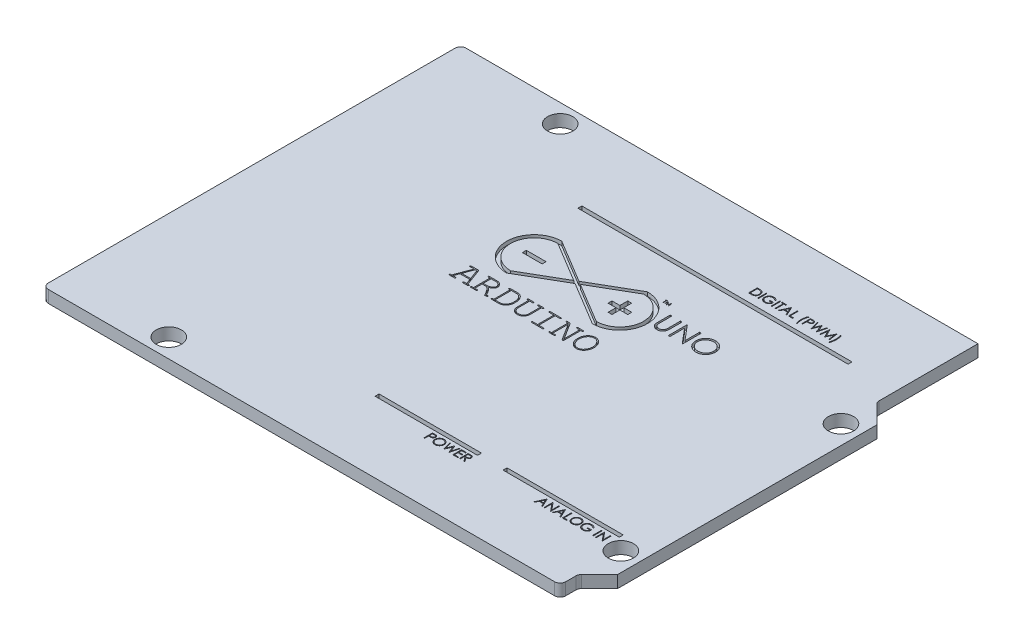
from build123d import *

# Parameters (mm, degrees)
ESQUISSE1_R        = 1.6
BOSS_EXTRU_1_DEPTH = 1.55
CONG_1_R           = 0.7
SKETCH1_W          = 34.298310343
SKETCH1_H          = 0.5
CUT_EXTRUDE1_DEPTH = 0.5
SKETCH2_W          = 0.100213675
SKETCH2_H          = 1.11666667
SKETCH2_W_2        = 0.100213676
CUT_EXTRUDE2_DEPTH = 0.5
SKETCH3_W          = 13
SKETCH3_H          = 0.5
SKETCH3_W_2        = 14.75
SKETCH3_W_3        = 0.100213676
SKETCH3_H_2        = 1.11666667
CUT_EXTRUDE3_DEPTH = 0.5
SKETCH5_W          = 2.5
SKETCH5_H          = 0.5
CUT_EXTRUDE4_DEPTH = 0.5
CUT_EXTRUDE5_DEPTH = 0.5


with BuildPart() as part:
    # Esquisse1 → Boss.-Extru.1 (new body)
    with BuildSketch(Plane(origin=(0, 0, 0), x_dir=(1, 0, 0), z_dir=(0, 1, 0))):
        Polygon((65.7, 53.05), (65.7, 40.2), (68.2, 37.7), (68.2, 4.8), (65.7, 2.3), (65.7, 0), (0, 0), (0, 53.05), align=None)
        with Locations(Location((15, 50.7, 0), (0, 0, 90))):
            Circle(ESQUISSE1_R, mode=Mode.SUBTRACT)
        with Locations(Location((13.6, 2.4, 0), (0, 0, 90))):
            Circle(ESQUISSE1_R, mode=Mode.SUBTRACT)
        with Locations(Location((65.8, 7.6, 0), (0, 0, 90))):
            Circle(ESQUISSE1_R, mode=Mode.SUBTRACT)
        with Locations(Location((65.8, 35.55, 0), (0, 0, 90))):
            Circle(ESQUISSE1_R, mode=Mode.SUBTRACT)
    extrude(amount=BOSS_EXTRU_1_DEPTH)

    # Congé1
    cong_1_edges = [part.edges().sort_by_distance(p)[0] for p in [
        (0, 0.775, -53.05),
        (65.7, 0.775, -40.2),
        (65.7, 0.775, -2.3),
        (65.7, 0.775, 0),
        (0, 0.775, 0),
    ]]
    fillet(cong_1_edges, radius=CONG_1_R)

    # Sketch1 → Cut-Extrude1 (cut)
    with BuildSketch(Plane(origin=(0, 1.55, 0), x_dir=(1, 0, 0), z_dir=(0, 1, 0))):
        with Locations((42.550844829, 42.8)):
            Rectangle(SKETCH1_W, SKETCH1_H)
    extrude(amount=-CUT_EXTRUDE1_DEPTH, mode=Mode.SUBTRACT)

    # Sketch2 → Cut-Extrude2 (cut)
    # profile 1 of 12: a face of its own
    with BuildSketch(Plane(origin=(0, 1.55, 0), x_dir=(1, 0, 0), z_dir=(0, 1, 0))):
        with BuildLine():
            Line((56.142718668, 43.751383237), (56.013872514, 43.751383237))
            add(Edge.make_bspline(
                [(56.013872514, 43.751383237), (56.019885255, 43.764154599), (56.032080457, 43.790057818), (56.048309931, 43.830399291), (56.064401001, 43.871961485), (56.079105335, 43.915285847), (56.092876771, 43.960143815), (56.106012761, 44.006554343), (56.117628207, 44.054612861), (56.132764769, 44.1207357), (56.148447274, 44.205329011), (56.161438244, 44.308705807), (56.169840661, 44.413593634), (56.17084596, 44.484105228), (56.171351147, 44.519538955)],
                knots=[0, 0, 0, 0, 0.643010096, 1.304170363, 1.980525948, 2.673468857, 3.388058623, 4.118367826, 4.870637152, 5.640399836, 7.208918794, 8.78781499, 10.385801844, 12, 12, 12, 12], degree=3))
            add(Edge.make_bspline(
                [(56.171351147, 44.519538955), (56.17088194, 44.552355447), (56.169952275, 44.61737663), (56.163718452, 44.714075125), (56.152614718, 44.808834149), (56.137818027, 44.901261912), (56.119117355, 44.989997439), (56.097377758, 45.073910301), (56.072313271, 45.152352339), (56.052273989, 45.201833972), (56.042504993, 45.225955891)],
                knots=[0, 0, 0, 0, 1.089953881, 2.159587681, 3.216624426, 4.25769169, 5.267486842, 6.22737404, 7.135858364, 8, 8, 8, 8], degree=3))
            Line((56.042504993, 45.225955891), (56.142718668, 45.225955891))
            add(Edge.make_bspline(
                [(56.142718668, 45.225955891), (56.147650793, 45.214582956), (56.157635647, 45.191558981), (56.17126254, 45.155777915), (56.184091823, 45.118581671), (56.196571504, 45.079944655), (56.207872895, 45.039775439), (56.218353486, 44.998054478), (56.228260632, 44.954898321), (56.240095561, 44.895096966), (56.25298951, 44.818648973), (56.263565163, 44.725010324), (56.270253594, 44.629618511), (56.271125679, 44.565332199), (56.271564822, 44.53296043)],
                knots=[0, 0, 0, 0, 0.628844065, 1.27306534, 1.941820192, 2.624928913, 3.332648663, 4.058377701, 4.807203874, 5.57876041, 7.15092291, 8.738794632, 10.357799901, 12, 12, 12, 12], degree=3))
            add(Edge.make_bspline(
                [(56.271564822, 44.53296043), (56.271206707, 44.498054436), (56.270495247, 44.428707552), (56.263896502, 44.325288929), (56.25381921, 44.223174699), (56.239215977, 44.122746824), (56.220976863, 44.024828325), (56.199199432, 43.930109513), (56.173364168, 43.839083481), (56.152847622, 43.78036993), (56.142718668, 43.751383237)],
                knots=[0, 0, 0, 0, 1.05226665, 2.090512442, 3.123047645, 4.145154173, 5.149102219, 6.125200057, 7.074417238, 8, 8, 8, 8], degree=3))
        make_face()
    # profile 2 of 12: a face of its own
    with BuildSketch(Plane(origin=(0, 1.55, 0), x_dir=(1, 0, 0), z_dir=(0, 1, 0))):
        Polygon((54.596564817, 44.066340503), (54.743977344, 45.183007173), (54.758293584, 45.183007173), (55.219321229, 44.266767854), (55.679230419, 45.183007173), (55.693770349, 45.183007173), (55.842077642, 44.066340503), (55.741416584, 44.066340503), (55.634492171, 44.869839437), (55.231400556, 44.066340503), (55.208807741, 44.066340503), (54.804150288, 44.871628967), (54.697449567, 44.066340503), align=None)
    # profile 3 of 12: a face of its own
    with BuildSketch(Plane(origin=(0, 1.55, 0), x_dir=(1, 0, 0), z_dir=(0, 1, 0))):
        Polygon((53.150624642, 45.183007173), (53.254193686, 45.183007173), (53.472740028, 44.364073544), (53.797763399, 45.183007173), (53.81230333, 45.183007173), (54.131287038, 44.369665825), (54.350951836, 45.183007173), (54.453402424, 45.183007173), (54.152314015, 44.066340503), (54.137997775, 44.066340503), (53.802013533, 44.920393658), (53.462002848, 44.066340503), (53.447686609, 44.066340503), align=None)
    # profile 4 of 12: a face of its own
    with BuildSketch(Plane(origin=(0, 1.55, 0), x_dir=(1, 0, 0), z_dir=(0, 1, 0))):
        with BuildLine():
            Line((52.30596652, 45.183007173), (52.524960244, 45.183007173))
            add(Edge.make_bspline(
                [(52.524960244, 45.183007173), (52.540022771, 45.182990616), (52.568883242, 45.182958891), (52.610268522, 45.181997044), (52.647855437, 45.180712337), (52.681562939, 45.178931447), (52.711494742, 45.176826821), (52.737515404, 45.17387498), (52.759829453, 45.170792886), (52.773199606, 45.167659389), (52.779297184, 45.16623033)],
                knots=[0, 0, 0, 0, 1.415646017, 2.712440637, 3.8905458, 4.950247383, 5.884950622, 6.709939814, 7.411656543, 8, 8, 8, 8], degree=3))
            add(Edge.make_bspline(
                [(52.779297184, 45.16623033), (52.787016073, 45.164117613), (52.802271966, 45.159941962), (52.82425468, 45.151578536), (52.845169478, 45.141661845), (52.865088118, 45.130359921), (52.88376583, 45.11718786), (52.901481282, 45.102679611), (52.918078133, 45.086500205), (52.933463053, 45.068831112), (52.947592012, 45.04996895), (52.959757197, 45.029632143), (52.969943503, 45.008163013), (52.97868007, 44.985576493), (52.984968006, 44.961682913), (52.989704874, 44.936648295), (52.99271146, 44.910475323), (52.99299942, 44.892589555), (52.993146009, 44.883484603)],
                knots=[0, 0, 0, 0, 0.999701418, 1.975846123, 2.934577507, 3.890451536, 4.834027766, 5.787354733, 6.749476667, 7.726910423, 8.712836071, 9.690891519, 10.682875813, 11.679750201, 12.712814741, 13.765529915, 14.8625177, 16, 16, 16, 16], degree=3))
            add(Edge.make_bspline(
                [(52.993146009, 44.883484603), (52.993011555, 44.874303122), (52.992748485, 44.856338934), (52.989591099, 44.830058092), (52.985338133, 44.804943177), (52.978798597, 44.781049876), (52.970233549, 44.758520082), (52.960186085, 44.737009499), (52.94806753, 44.716884079), (52.934142751, 44.698070761), (52.91865248, 44.680551884), (52.901662257, 44.664454402), (52.883240673, 44.649872542), (52.863446273, 44.636773613), (52.842086083, 44.625461371), (52.819484063, 44.615329279), (52.795443756, 44.60681994), (52.778807811, 44.602343683), (52.770349534, 44.600067802)],
                knots=[0, 0, 0, 0, 1.121902311, 2.195077645, 3.232258892, 4.234102512, 5.217864754, 6.176164875, 7.132989551, 8.084763148, 9.034132444, 9.988522005, 10.94243251, 11.903244335, 12.886203696, 13.894208494, 14.929344452, 16, 16, 16, 16], degree=3))
            add(Edge.make_bspline(
                [(52.770349534, 44.600067802), (52.76335367, 44.598580089), (52.748021828, 44.595319679), (52.722771531, 44.591679838), (52.693372765, 44.58857308), (52.659865657, 44.586243669), (52.622280282, 44.584249504), (52.580596309, 44.582664446), (52.534731913, 44.581793492), (52.502740611, 44.581748573), (52.486037968, 44.58172512)],
                knots=[0, 0, 0, 0, 0.601384939, 1.31797006, 2.144135048, 3.087295005, 4.142315834, 5.309527816, 6.595305764, 8, 8, 8, 8], degree=3))
            Line((52.486037968, 44.58172512), (52.406180195, 44.58172512))
            Line((52.406180195, 44.58172512), (52.406180195, 44.066340503))
            Line((52.406180195, 44.066340503), (52.30596652, 44.066340503))
            Line((52.30596652, 44.066340503), (52.30596652, 45.183007173))
        make_face()
        with BuildLine():
            Line((52.406180195, 45.068477258), (52.406180195, 44.696255035))
            Line((52.406180195, 44.696255035), (52.601686339, 44.693794431))
            add(Edge.make_bspline(
                [(52.601686339, 44.693794431), (52.61123222, 44.693789498), (52.629660347, 44.693779974), (52.656280475, 44.69505145), (52.680977724, 44.696519239), (52.703676232, 44.698668319), (52.72438623, 44.701706053), (52.743142251, 44.704772656), (52.75979886, 44.709209128), (52.779292415, 44.715182679), (52.801014245, 44.725370704), (52.82464532, 44.740158526), (52.844672127, 44.759008086), (52.86200225, 44.780201727), (52.875755078, 44.803779068), (52.885822942, 44.829005824), (52.891738454, 44.855623281), (52.892531668, 44.873837116), (52.892932334, 44.88303722)],
                knots=[0, 0, 0, 0, 1.160613943, 2.240541288, 3.23993089, 4.169200891, 5.011653406, 5.7853311, 6.478053781, 7.106038997, 8.262395093, 9.384106736, 10.481365981, 11.59014053, 12.70357646, 13.786202915, 14.881775077, 16, 16, 16, 16], degree=3))
            add(Edge.make_bspline(
                [(52.892932334, 44.88303722), (52.892529489, 44.892014746), (52.891728685, 44.909860956), (52.885776576, 44.936016085), (52.875774652, 44.960977), (52.861909929, 44.984258889), (52.845082997, 45.00537627), (52.825525587, 45.023720591), (52.803283737, 45.038467515), (52.782594063, 45.047985753), (52.764216542, 45.053797293), (52.748253964, 45.057863504), (52.730230749, 45.061110007), (52.710141029, 45.063738801), (52.688140515, 45.065989191), (52.664040196, 45.067516146), (52.637931366, 45.068409944), (52.619806089, 45.068454277), (52.610410298, 45.068477258)],
                knots=[0, 0, 0, 0, 1.120700087, 2.227813068, 3.331159281, 4.466773991, 5.599788987, 6.693661531, 7.80175334, 8.91857717, 9.525282508, 10.207424825, 10.974604443, 11.810962634, 12.737642355, 13.736264703, 14.826523623, 16, 16, 16, 16], degree=3))
            Line((52.610410298, 45.068477258), (52.406180195, 45.068477258))
        make_face(mode=Mode.SUBTRACT)
    # profile 5 of 12: a face of its own
    with BuildSketch(Plane(origin=(0, 1.55, 0), x_dir=(1, 0, 0), z_dir=(0, 1, 0))):
        with BuildLine():
            Line((51.933744297, 45.225955891), (52.062590451, 45.225955891))
            add(Edge.make_bspline(
                [(52.062590451, 45.225955891), (52.05667254, 45.213175476), (52.044656296, 45.187225003), (52.028326943, 45.146989206), (52.012493693, 45.105376214), (51.998152439, 45.061966478), (51.983881597, 45.017188546), (51.971073147, 44.970645026), (51.958905392, 44.922634024), (51.944028696, 44.856427186), (51.928306428, 44.771846774), (51.914935959, 44.668578769), (51.906643577, 44.563743033), (51.905624119, 44.493233077), (51.905111818, 44.457800173)],
                knots=[0, 0, 0, 0, 0.641680859, 1.302924882, 1.97816193, 2.670100703, 3.385789831, 4.119463781, 4.869353995, 5.64252846, 7.211246119, 8.787408069, 10.385597356, 12, 12, 12, 12], degree=3))
            add(Edge.make_bspline(
                [(51.905111818, 44.457800173), (51.905578474, 44.425057708), (51.90650519, 44.360035633), (51.91279628, 44.263428318), (51.923580995, 44.168565767), (51.938444457, 44.07615799), (51.956998068, 43.987363959), (51.97923565, 43.903565239), (52.004082843, 43.825040883), (52.024175809, 43.77550133), (52.033957972, 43.751383237)],
                knots=[0, 0, 0, 0, 1.087438645, 2.159504985, 3.213761363, 4.257235816, 5.266994431, 6.225081839, 7.135889631, 8, 8, 8, 8], degree=3))
            Line((52.033957972, 43.751383237), (51.933744297, 43.751383237))
            add(Edge.make_bspline(
                [(51.933744297, 43.751383237), (51.928905532, 43.762764011), (51.919098069, 43.785831164), (51.905420753, 43.821457971), (51.892732109, 43.858658632), (51.880685446, 43.897307134), (51.869266792, 43.937432352), (51.858508101, 43.97895569), (51.84873107, 44.02202493), (51.836388568, 44.081514668), (51.823802264, 44.157970362), (51.812829549, 44.251489989), (51.806224151, 44.346902805), (51.805342578, 44.411113021), (51.804898142, 44.443483934)],
                knots=[0, 0, 0, 0, 0.628236805, 1.273343465, 1.938200331, 2.624718736, 3.329767296, 4.057431036, 4.803593529, 5.573251756, 7.143838059, 8.738091941, 10.355542947, 12, 12, 12, 12], degree=3))
            add(Edge.make_bspline(
                [(51.804898142, 44.443483934), (51.805263454, 44.478463849), (51.805990773, 44.548107332), (51.812495392, 44.651758721), (51.822758243, 44.754064282), (51.83694215, 44.854537927), (51.855209201, 44.95254271), (51.87732784, 45.047196732), (51.903082264, 45.138259631), (51.923609879, 45.196970515), (51.933744297, 45.225955891)],
                knots=[0, 0, 0, 0, 1.053308321, 2.097090816, 3.12621109, 4.149053282, 5.151853223, 6.127344058, 7.075475725, 8, 8, 8, 8], degree=3))
        make_face()
    # profile 6 of 12: a face of its own
    with BuildSketch(Plane(origin=(0, 1.55, 0), x_dir=(1, 0, 0), z_dir=(0, 1, 0))):
        Polygon((50.616650276, 45.183007173), (50.716863951, 45.183007173), (50.716863951, 44.180870418), (51.146351132, 44.180870418), (51.146351132, 44.066340503), (50.616650276, 44.066340503), align=None)
    # profile 7 of 12: a face of its own
    with BuildSketch(Plane(origin=(0, 1.55, 0), x_dir=(1, 0, 0), z_dir=(0, 1, 0))):
        Polygon((49.900838308, 45.183007173), (50.416222925, 44.066340503), (50.307285291, 44.066340503), (50.142201156, 44.424246487), (49.635987879, 44.424246487), (49.466206228, 44.066340503), (49.356821212, 44.066340503), (49.886522068, 45.183007173), align=None)
        Polygon((49.892561732, 44.965355597), (49.690344851, 44.538776402), (50.089410023, 44.538776402), align=None, mode=Mode.SUBTRACT)
    # profile 8 of 12: a face of its own
    with BuildSketch(Plane(origin=(0, 1.55, 0), x_dir=(1, 0, 0), z_dir=(0, 1, 0))):
        Polygon((48.683957962, 45.068477258), (48.683957962, 45.183007173), (49.270923776, 45.183007173), (49.270923776, 45.068477258), (49.027547707, 45.068477258), (49.027547707, 44.066340503), (48.927334031, 44.066340503), (48.927334031, 45.068477258), align=None)
    # profile 9 of 12: a face of its own
    with BuildSketch(Plane(origin=(0, 1.55, 0), x_dir=(1, 0, 0), z_dir=(0, 1, 0))):
        with Locations((48.476372492, 44.624673838)):
            Rectangle(SKETCH2_W, SKETCH2_H)
    # profile 10 of 12: a face of its own
    with BuildSketch(Plane(origin=(0, 1.55, 0), x_dir=(1, 0, 0), z_dir=(0, 1, 0))):
        with BuildLine():
            Line((48.125624627, 44.992422237), (48.039727191, 44.910998625))
            add(Edge.make_bspline(
                [(48.039727191, 44.910998625), (48.024183546, 44.925620853), (47.993466902, 44.954516633), (47.94338911, 44.992008237), (47.891140713, 45.024125516), (47.836994344, 45.050257506), (47.782290901, 45.071108149), (47.727756482, 45.085952841), (47.673950472, 45.095419794), (47.638163788, 45.096551893), (47.620529807, 45.097109737)],
                knots=[0, 0, 0, 0, 1.08915593, 2.152340314, 3.188132944, 4.216796309, 5.218260357, 6.173443236, 7.099959455, 8, 8, 8, 8], degree=3))
            add(Edge.make_bspline(
                [(47.620529807, 45.097109737), (47.609709403, 45.096977777), (47.588096658, 45.096714199), (47.555993466, 45.093350093), (47.524226967, 45.088511779), (47.492857128, 45.081511275), (47.461822956, 45.072638861), (47.431232386, 45.061540641), (47.401028353, 45.048601587), (47.371495365, 45.033650227), (47.342863871, 45.017225704), (47.315822405, 44.999024503), (47.290198606, 44.979629984), (47.266474089, 44.958556577), (47.244512387, 44.935995167), (47.223790763, 44.912365445), (47.205038007, 44.887021828), (47.188099397, 44.860430604), (47.172988785, 44.833058811), (47.159649834, 44.805169904), (47.148452192, 44.776856389), (47.139592413, 44.748082735), (47.132282823, 44.719071547), (47.127140539, 44.689621946), (47.124241442, 44.659702398), (47.123739969, 44.639667083), (47.123487872, 44.629595046)],
                knots=[0, 0, 0, 0, 1.02818874, 2.053710826, 3.065248034, 4.081641283, 5.106893873, 6.131558223, 7.173050175, 8.228653731, 9.27666206, 10.308777013, 11.325269123, 12.329503258, 13.32196095, 14.316845687, 15.314881793, 16.315733098, 17.311955233, 18.285320748, 19.252783886, 20.203351036, 21.145449891, 22.095197417, 23.042428769, 24, 24, 24, 24], degree=3))
            add(Edge.make_bspline(
                [(47.123487872, 44.629595046), (47.123728982, 44.619299118), (47.124210544, 44.598735378), (47.127292646, 44.568044888), (47.133012608, 44.537810212), (47.140659449, 44.507931998), (47.150224757, 44.478359076), (47.162148417, 44.449219656), (47.176271251, 44.420514817), (47.192618151, 44.392503196), (47.210544226, 44.365217279), (47.230626066, 44.339514955), (47.251957776, 44.315053965), (47.275316497, 44.292377411), (47.299953208, 44.270878739), (47.326603982, 44.251150263), (47.354744767, 44.232811973), (47.384418496, 44.216094988), (47.415303194, 44.201160836), (47.446970824, 44.187880831), (47.479522556, 44.17694409), (47.512787319, 44.168030505), (47.546725458, 44.160724219), (47.581509243, 44.156023857), (47.616882917, 44.152612973), (47.640728099, 44.152363583), (47.652741346, 44.152237939)],
                knots=[0, 0, 0, 0, 0.93586088, 1.869166235, 2.799637598, 3.729985548, 4.670839027, 5.622275134, 6.589130586, 7.576015415, 8.568469353, 9.55398029, 10.53834874, 11.515998671, 12.510579167, 13.508179873, 14.527009472, 15.561807829, 16.601455013, 17.643573243, 18.680854198, 19.719860599, 20.772568776, 21.833555941, 22.908541556, 24, 24, 24, 24], degree=3))
            add(Edge.make_bspline(
                [(47.652741346, 44.152237939), (47.667219199, 44.15254058), (47.695648817, 44.153134865), (47.73743973, 44.157761148), (47.7775769, 44.164986554), (47.815947546, 44.175568054), (47.852596234, 44.189064941), (47.887657315, 44.205334898), (47.920854749, 44.225001969), (47.952288333, 44.247199346), (47.981244198, 44.271930268), (48.007359561, 44.298616833), (48.030217884, 44.327129502), (48.050159859, 44.35730034), (48.066657382, 44.389379081), (48.080198655, 44.423208517), (48.090578324, 44.458803867), (48.094839197, 44.483399768), (48.096992148, 44.495827684)],
                knots=[0, 0, 0, 0, 1.13008108, 2.219097802, 3.278683437, 4.311054135, 5.322181354, 6.324827112, 7.324222904, 8.330512327, 9.32562643, 10.293043162, 11.24128371, 12.174520618, 13.111833804, 14.052305215, 15.015860969, 16, 16, 16, 16], degree=3))
            Line((48.096992148, 44.495827684), (47.724769925, 44.495827684))
            Line((47.724769925, 44.495827684), (47.724769925, 44.610357599))
            Line((47.724769925, 44.610357599), (48.197205824, 44.610357599))
            add(Edge.make_bspline(
                [(48.197205824, 44.610357599), (48.196661577, 44.589010924), (48.195596388, 44.547231625), (48.188124638, 44.486303014), (48.17605937, 44.428755855), (48.159577271, 44.374529541), (48.138240871, 44.323700919), (48.11227916, 44.27621838), (48.081276626, 44.232388677), (48.04633758, 44.191853995), (48.007126641, 44.15569658), (47.964703319, 44.123917542), (47.918997525, 44.097148612), (47.870052491, 44.075370211), (47.818028448, 44.058373269), (47.762805012, 44.046322338), (47.704457072, 44.039102302), (47.664468704, 44.038179814), (47.644017387, 44.037708025)],
                knots=[0, 0, 0, 0, 1.140356446, 2.231883559, 3.274166699, 4.278491846, 5.25512956, 6.21435461, 7.1637429, 8.11826594, 9.068280886, 10.0076534, 10.945064095, 11.891975133, 12.864533718, 13.863980011, 14.907571808, 16, 16, 16, 16], degree=3))
            add(Edge.make_bspline(
                [(47.644017387, 44.037708025), (47.631411773, 44.037889601), (47.606549438, 44.038247729), (47.569829951, 44.040792883), (47.534122901, 44.044710972), (47.499433488, 44.050627749), (47.465634112, 44.057874805), (47.432893578, 44.067154854), (47.401087165, 44.077896772), (47.370165712, 44.090114916), (47.340409881, 44.104271587), (47.311687135, 44.12000371), (47.283838704, 44.137230164), (47.257054285, 44.156248862), (47.23119432, 44.176917552), (47.206425554, 44.199277659), (47.182609326, 44.223260826), (47.167690512, 44.240291272), (47.160173235, 44.248872555)],
                knots=[0, 0, 0, 0, 1.107784379, 2.184907829, 3.233506516, 4.263428166, 5.276301166, 6.270063455, 7.25232949, 8.225834625, 9.190232166, 10.146266622, 11.1027726, 12.066435141, 13.031522626, 14.010570082, 14.99756817, 16, 16, 16, 16], degree=3))
            add(Edge.make_bspline(
                [(47.160173235, 44.248872555), (47.149266295, 44.262486525), (47.127633459, 44.289488488), (47.09978757, 44.332751328), (47.07604998, 44.377546207), (47.05678977, 44.423997827), (47.041750476, 44.472062738), (47.030964671, 44.521679521), (47.024645203, 44.57291207), (47.023734788, 44.607581464), (47.023274196, 44.625121221)],
                knots=[0, 0, 0, 0, 1.023165419, 2.029347347, 3.013907458, 3.994755782, 4.975994455, 5.96558838, 6.970761222, 8, 8, 8, 8], degree=3))
            add(Edge.make_bspline(
                [(47.023274196, 44.625121221), (47.023444006, 44.638255216), (47.023781466, 44.664356281), (47.027873417, 44.703106945), (47.033744345, 44.741169547), (47.042373644, 44.778512973), (47.053251976, 44.815162161), (47.066828564, 44.851134131), (47.082635745, 44.886450109), (47.101008261, 44.92086701), (47.121454255, 44.953928132), (47.143644087, 44.985500384), (47.167892855, 45.0150088), (47.193804563, 45.042827088), (47.221688364, 45.068605768), (47.251283038, 45.092583508), (47.28261139, 45.114792472), (47.315771981, 45.134882848), (47.350269861, 45.152929336), (47.386022338, 45.168750656), (47.423018497, 45.181826286), (47.460981169, 45.192920777), (47.500197705, 45.201125132), (47.540383519, 45.207074969), (47.581748079, 45.211146208), (47.609708145, 45.211473633), (47.623885176, 45.211639652)],
                knots=[0, 0, 0, 0, 1.008945113, 2.00506715, 2.99143336, 3.967273523, 4.948097931, 5.927297278, 6.919902385, 7.919676788, 8.923139349, 9.905703106, 10.883022732, 11.856032218, 12.825136022, 13.798837087, 14.781400844, 15.773989409, 16.776158564, 17.77167057, 18.775803737, 19.789618931, 20.80898985, 21.851988756, 22.910860228, 24, 24, 24, 24], degree=3))
            add(Edge.make_bspline(
                [(47.623885176, 45.211639652), (47.635446901, 45.211454767), (47.658372444, 45.21108816), (47.692486844, 45.208547058), (47.726073949, 45.204519439), (47.759183559, 45.199023274), (47.791702924, 45.191537239), (47.823724682, 45.182578929), (47.855295254, 45.172148681), (47.886315695, 45.159709383), (47.916994586, 45.145590369), (47.947502506, 45.129697515), (47.977735218, 45.111759061), (48.00774515, 45.091721743), (48.037721543, 45.0699297), (48.067190263, 45.045759665), (48.096862631, 45.020164786), (48.115942257, 45.001761423), (48.125624627, 44.992422237)],
                knots=[0, 0, 0, 0, 0.985871117, 1.954866573, 2.915460327, 3.869826059, 4.81536089, 5.759505086, 6.70452669, 7.649098992, 8.607881297, 9.583363685, 10.581137262, 11.603961102, 12.659522466, 13.73993555, 14.853081303, 16, 16, 16, 16], degree=3))
        make_face()
    # profile 11 of 12: a face of its own
    with BuildSketch(Plane(origin=(0, 1.55, 0), x_dir=(1, 0, 0), z_dir=(0, 1, 0))):
        with Locations((46.744107529, 44.624673838)):
            Rectangle(SKETCH2_W_2, SKETCH2_H)
    # profile 12 of 12: a face of its own
    with BuildSketch(Plane(origin=(0, 1.55, 0), x_dir=(1, 0, 0), z_dir=(0, 1, 0))):
        with BuildLine():
            Line((45.548701542, 44.066340503), (45.548701542, 45.183007173))
            Line((45.548701542, 45.183007173), (45.774182312, 45.183007173))
            add(Edge.make_bspline(
                [(45.774182312, 45.183007173), (45.793793847, 45.182865972), (45.831683229, 45.182593173), (45.886435772, 45.180863491), (45.937095354, 45.177803676), (45.983495361, 45.173346732), (46.025763177, 45.167874097), (46.063780447, 45.161014444), (46.09774375, 45.152914409), (46.118631619, 45.14600848), (46.128509237, 45.14274275)],
                knots=[0, 0, 0, 0, 1.314313732, 2.53924729, 3.670748893, 4.714932338, 5.66265055, 6.526160246, 7.303039223, 8, 8, 8, 8], degree=3))
            add(Edge.make_bspline(
                [(46.128509237, 45.14274275), (46.141428987, 45.13781962), (46.16697551, 45.128085001), (46.203349211, 45.1097218), (46.237591113, 45.088915715), (46.26988484, 45.06563932), (46.299492723, 45.039233552), (46.327571433, 45.010820101), (46.352972321, 44.979365725), (46.376233539, 44.945522753), (46.397206345, 44.90968986), (46.415436457, 44.871935325), (46.430576541, 44.832450883), (46.443144856, 44.791346335), (46.453050155, 44.7485313), (46.459808199, 44.703955924), (46.464265611, 44.657796373), (46.46471357, 44.626474044), (46.464940861, 44.61058129)],
                knots=[0, 0, 0, 0, 0.984719456, 1.947108742, 2.898477687, 3.838006223, 4.779231079, 5.722358779, 6.681677486, 7.655904652, 8.64651281, 9.637519902, 10.640069247, 11.656948941, 12.698408672, 13.768548281, 14.867775369, 16, 16, 16, 16], degree=3))
            add(Edge.make_bspline(
                [(46.464940861, 44.61058129), (46.464740191, 44.596778895), (46.464344749, 44.569579834), (46.460793967, 44.529494405), (46.45563295, 44.49059817), (46.447642659, 44.453076351), (46.437942809, 44.416600206), (46.425511389, 44.381558489), (46.411270541, 44.34762975), (46.394664151, 44.315272746), (46.376433328, 44.284617575), (46.356868772, 44.255719668), (46.33599135, 44.228991383), (46.313601981, 44.204351778), (46.289989995, 44.181837998), (46.265000804, 44.161261974), (46.238569926, 44.143026311), (46.210815743, 44.126414424), (46.180928597, 44.111923168), (46.148342392, 44.099662165), (46.112918159, 44.089501578), (46.074742848, 44.081024197), (46.033750501, 44.074299534), (45.989900926, 44.069792542), (45.943261495, 44.066744701), (45.911235729, 44.066477852), (45.894751891, 44.066340503)],
                knots=[0, 0, 0, 0, 1.105936401, 2.179363191, 3.223086493, 4.248585256, 5.251745608, 6.245858792, 7.225916811, 8.198733463, 9.158002045, 10.082870192, 10.993790845, 11.873723703, 12.748670949, 13.606408763, 14.465103618, 15.319838547, 16.196477973, 17.123216899, 18.106603292, 19.147568657, 20.255746949, 21.433717677, 22.679120308, 24, 24, 24, 24], degree=3))
            Line((45.894751891, 44.066340503), (45.548701542, 44.066340503))
        make_face()
        with BuildLine():
            Line((45.648915218, 44.180870418), (45.777090298, 44.180870418))
            add(Edge.make_bspline(
                [(45.777090298, 44.180870418), (45.795508398, 44.180949573), (45.830933148, 44.181101816), (45.881871652, 44.182437733), (45.928414126, 44.184620637), (45.970567179, 44.187675543), (46.008307011, 44.191717434), (46.041712493, 44.196223951), (46.070674123, 44.201838376), (46.088199229, 44.206927491), (46.096297698, 44.209279206)],
                knots=[0, 0, 0, 0, 1.375205317, 2.645023457, 3.804390687, 4.853969522, 5.800190428, 6.637939096, 7.370582563, 8, 8, 8, 8], degree=3))
            add(Edge.make_bspline(
                [(46.096297698, 44.209279206), (46.106490747, 44.212868988), (46.126633384, 44.219962812), (46.155628778, 44.232902638), (46.182670298, 44.248230346), (46.208229211, 44.265268214), (46.231942954, 44.284617177), (46.254092553, 44.305856492), (46.274633413, 44.329094254), (46.293353312, 44.35430162), (46.310105961, 44.381321697), (46.324613449, 44.409888849), (46.337327985, 44.43969007), (46.347307346, 44.471182992), (46.355128984, 44.504086073), (46.360669147, 44.538401626), (46.364119559, 44.574123245), (46.364522021, 44.598419399), (46.364727186, 44.610804981)],
                knots=[0, 0, 0, 0, 0.998632004, 1.973411704, 2.929992603, 3.868527914, 4.809262121, 5.754881198, 6.702106254, 7.672490631, 8.653608572, 9.636854334, 10.631411391, 11.644891563, 12.686317036, 13.754757253, 14.855430412, 16, 16, 16, 16], degree=3))
            add(Edge.make_bspline(
                [(46.364727186, 44.610804981), (46.364563423, 44.623864711), (46.364241709, 44.649520665), (46.360198, 44.687165315), (46.354288742, 44.723371047), (46.345743471, 44.758140281), (46.334854095, 44.79154085), (46.321264376, 44.823388028), (46.305737407, 44.854018153), (46.287263485, 44.88272426), (46.267030891, 44.909873014), (46.244576996, 44.934744344), (46.220258536, 44.957394907), (46.194340751, 44.978177449), (46.1660932, 44.99625586), (46.136181308, 45.012427325), (46.10416626, 45.026151443), (46.081892686, 45.03345089), (46.070573205, 45.037160485)],
                knots=[0, 0, 0, 0, 1.122418816, 2.205001699, 3.251619955, 4.274784885, 5.280384055, 6.268708349, 7.249350384, 8.229342522, 9.199999885, 10.157847722, 11.105861043, 12.055065948, 13.010012805, 13.98527497, 14.976112212, 16, 16, 16, 16], degree=3))
            add(Edge.make_bspline(
                [(46.070573205, 45.037160485), (46.061208792, 45.039750012), (46.04129748, 45.045256057), (46.008805841, 45.051262247), (45.972238151, 45.056559873), (45.931432055, 45.061045057), (45.886434071, 45.064263393), (45.837209589, 45.066679003), (45.783737334, 45.068308262), (45.746669573, 45.068419516), (45.727430843, 45.068477258)],
                knots=[0, 0, 0, 0, 0.674548936, 1.434276114, 2.292660221, 3.240891867, 4.284742987, 5.42552168, 6.663806718, 8, 8, 8, 8], degree=3))
            Line((45.727430843, 45.068477258), (45.648915218, 45.068477258))
            Line((45.648915218, 45.068477258), (45.648915218, 44.180870418))
        make_face(mode=Mode.SUBTRACT)
    extrude(amount=-CUT_EXTRUDE2_DEPTH, mode=Mode.SUBTRACT)

    # Sketch3 → Cut-Extrude3 (cut)
    # profile 1 of 15: a face of its own
    with BuildSketch(Plane(origin=(0, 1.55, 0), x_dir=(1, 0, 0), z_dir=(0, 1, 0))):
        with Locations((39.7, 9.25)):
            Rectangle(SKETCH3_W, SKETCH3_H)
    # profile 2 of 15: a face of its own
    with BuildSketch(Plane(origin=(0, 1.55, 0), x_dir=(1, 0, 0), z_dir=(0, 1, 0))):
        with Locations((56.825, 9.25)):
            Rectangle(SKETCH3_W_2, SKETCH3_H)
    # profile 3 of 15: a face of its own
    with BuildSketch(Plane(origin=(0, 1.55, 0), x_dir=(1, 0, 0), z_dir=(0, 1, 0))):
        with BuildLine():
            Line((45.398290596, 8.61666667), (45.621758145, 8.61666667))
            add(Edge.make_bspline(
                [(45.621758145, 8.61666667), (45.63667079, 8.616617031), (45.665304722, 8.616521718), (45.706325718, 8.61599026), (45.743599125, 8.614467013), (45.777105455, 8.613156179), (45.806844093, 8.610765893), (45.832906229, 8.608481306), (45.855171827, 8.605490662), (45.868650266, 8.602713217), (45.874752937, 8.601455666)],
                knots=[0, 0, 0, 0, 1.410062039, 2.707475311, 3.878576406, 4.937260626, 5.877586885, 6.699081471, 7.410979367, 8, 8, 8, 8], degree=3))
            add(Edge.make_bspline(
                [(45.874752937, 8.601455666), (45.88292267, 8.599437126), (45.899087852, 8.595443108), (45.922362397, 8.587001236), (45.944540777, 8.577232117), (45.965530863, 8.565757978), (45.985227521, 8.552493643), (46.003833839, 8.5376681), (46.021434249, 8.521362467), (46.037316959, 8.503165637), (46.052292752, 8.484074941), (46.064923409, 8.463431361), (46.075811381, 8.441844112), (46.08448007, 8.41909365), (46.091460185, 8.395400608), (46.09638189, 8.370550373), (46.09933346, 8.344656157), (46.099633957, 8.326994348), (46.099786324, 8.318038865)],
                knots=[0, 0, 0, 0, 1.027469482, 2.033020251, 3.019912614, 3.986113645, 4.951240523, 5.91722682, 6.890402269, 7.87763091, 8.8651537, 9.85103654, 10.82876324, 11.815024772, 12.821070561, 13.842952187, 14.906261191, 16, 16, 16, 16], degree=3))
            add(Edge.make_bspline(
                [(46.099786324, 8.318038865), (46.099317644, 8.303160045), (46.098403127, 8.274127616), (46.089876547, 8.231993906), (46.075909752, 8.192690648), (46.05666375, 8.15626733), (46.03215468, 8.123433934), (46.002698675, 8.094595074), (45.968279303, 8.07046234), (45.936237569, 8.053727397), (45.907933515, 8.04300966), (45.88463241, 8.035468536), (45.859214851, 8.029642099), (45.831924368, 8.024422438), (45.802647392, 8.02048166), (45.771454093, 8.017595365), (45.738322226, 8.015791454), (45.715561665, 8.015522815), (45.70385283, 8.015384617)],
                knots=[0, 0, 0, 0, 1.260483769, 2.459530307, 3.627416485, 4.787058657, 5.939039949, 7.08810263, 8.267026773, 9.491475466, 10.141966685, 10.831826277, 11.566392101, 12.351337768, 13.187381173, 14.07005841, 15.007169909, 16, 16, 16, 16], degree=3))
            Line((45.70385283, 8.015384617), (46.114102564, 7.5))
            Line((46.114102564, 7.5), (45.990177617, 7.5))
            Line((45.990177617, 7.5), (45.579927883, 8.015384617))
            Line((45.579927883, 8.015384617), (45.498504271, 8.015384617))
            Line((45.498504271, 8.015384617), (45.498504271, 7.5))
            Line((45.498504271, 7.5), (45.398290596, 7.5))
            Line((45.398290596, 7.5), (45.398290596, 8.61666667))
        make_face()
        with BuildLine():
            Line((45.498504271, 8.502136755), (45.498504271, 8.129914532))
            Line((45.498504271, 8.129914532), (45.702958065, 8.128348693))
            add(Edge.make_bspline(
                [(45.702958065, 8.128348693), (45.712503982, 8.12834447), (45.731006688, 8.128336284), (45.757774996, 8.129610489), (45.782699031, 8.131060024), (45.805683462, 8.133277196), (45.826738555, 8.13613461), (45.845853787, 8.139708895), (45.863060361, 8.143873125), (45.88312799, 8.150318405), (45.905536788, 8.160529849), (45.929890159, 8.175386461), (45.950629, 8.194072799), (45.968150413, 8.215440521), (45.982229803, 8.23893399), (45.99215603, 8.264271594), (45.998454809, 8.290813675), (45.999197726, 8.309056215), (45.999572649, 8.318262556)],
                knots=[0, 0, 0, 0, 1.146690395, 2.22261258, 3.21895312, 4.145990853, 4.996080663, 5.770904154, 6.481378293, 7.121626537, 8.300444488, 9.431385265, 10.535395872, 11.636531494, 12.74115979, 13.810798291, 14.895190096, 16, 16, 16, 16], degree=3))
            add(Edge.make_bspline(
                [(45.999572649, 8.318262556), (45.999189115, 8.327242653), (45.998429091, 8.345037929), (45.992224008, 8.371090053), (45.981730729, 8.39567808), (45.967589824, 8.418701987), (45.950361522, 8.439601437), (45.930160125, 8.457483147), (45.907537991, 8.472238929), (45.886394323, 8.481668184), (45.867495789, 8.48744928), (45.851087278, 8.491517508), (45.832546949, 8.494785982), (45.811784779, 8.497404744), (45.788889402, 8.499655607), (45.763745051, 8.501171651), (45.736518554, 8.502069407), (45.717647867, 8.502113783), (45.707879272, 8.502136755)],
                knots=[0, 0, 0, 0, 1.101028733, 2.181837193, 3.264309656, 4.369019818, 5.486613113, 6.575447106, 7.666700264, 8.788928104, 9.402425223, 10.0903467, 10.862060571, 11.710948788, 12.657782767, 13.684531032, 14.801375019, 16, 16, 16, 16], degree=3))
            Line((45.707879272, 8.502136755), (45.498504271, 8.502136755))
        make_face(mode=Mode.SUBTRACT)
    # profile 4 of 15: a face of its own
    with BuildSketch(Plane(origin=(0, 1.55, 0), x_dir=(1, 0, 0), z_dir=(0, 1, 0))):
        Polygon((44.567948713, 8.61666667), (45.197863245, 8.61666667), (45.197863245, 8.502136755), (44.668162389, 8.502136755), (44.668162389, 8.158547011), (45.197863245, 8.158547011), (45.197863245, 8.044017096), (44.668162389, 8.044017096), (44.668162389, 7.614529915), (45.197863245, 7.614529915), (45.197863245, 7.5), (44.567948713, 7.5), align=None)
    # profile 5 of 15: a face of its own
    with BuildSketch(Plane(origin=(0, 1.55, 0), x_dir=(1, 0, 0), z_dir=(0, 1, 0))):
        Polygon((43.06474358, 8.61666667), (43.168312624, 8.61666667), (43.386858966, 7.79773304), (43.711882338, 8.61666667), (43.726422268, 8.61666667), (44.045405976, 7.803325321), (44.265070774, 8.61666667), (44.367521362, 8.61666667), (44.066432953, 7.5), (44.052116714, 7.5), (43.716132471, 8.354053154), (43.376121786, 7.5), (43.361805547, 7.5), align=None)
    # profile 6 of 15: a face of its own
    with BuildSketch(Plane(origin=(0, 1.55, 0), x_dir=(1, 0, 0), z_dir=(0, 1, 0))):
        with BuildLine():
            add(Edge.make_bspline(
                [(42.313141014, 8.645299149), (42.333817886, 8.644775439), (42.374428968, 8.643746829), (42.434114769, 8.63587302), (42.491095109, 8.622251157), (42.545834154, 8.604109158), (42.597677151, 8.579907997), (42.647014322, 8.550656068), (42.693728277, 8.516046912), (42.737189385, 8.476348064), (42.776960888, 8.433154295), (42.812000576, 8.387058962), (42.84136645, 8.338340772), (42.865481916, 8.287146126), (42.884400996, 8.233590803), (42.89745612, 8.177389287), (42.905795434, 8.118905724), (42.906770373, 8.079016201), (42.907264947, 8.058780717)],
                knots=[0, 0, 0, 0, 1.065120563, 2.091984664, 3.0946048, 4.079830382, 5.057816894, 6.036188127, 7.030412546, 8.04752943, 9.064399622, 10.05169764, 11.02544977, 11.989514704, 12.962713494, 13.945757189, 14.957906945, 16, 16, 16, 16], degree=3))
            add(Edge.make_bspline(
                [(42.907264947, 8.058780717), (42.906770445, 8.038694294), (42.905795724, 7.999101626), (42.897446638, 7.940989194), (42.884352604, 7.885126924), (42.865657605, 7.831608073), (42.841657095, 7.780376183), (42.812095683, 7.73156606), (42.77727444, 7.685161701), (42.73764654, 7.641671469), (42.694447159, 7.601791324), (42.648111788, 7.567041016), (42.599682491, 7.537138557), (42.54853606, 7.513279004), (42.49535081, 7.494208915), (42.439650735, 7.481206885), (42.381696835, 7.472820066), (42.342176086, 7.471857016), (42.322088664, 7.471367521)],
                knots=[0, 0, 0, 0, 1.043624062, 2.057103931, 3.04512605, 4.022047818, 4.998200453, 5.980619268, 6.982898556, 8.009068085, 9.034988726, 10.034168286, 11.015286542, 11.987931943, 12.962482838, 13.94673481, 14.956375938, 16, 16, 16, 16], degree=3))
            add(Edge.make_bspline(
                [(42.322088664, 7.471367521), (42.301853286, 7.471861849), (42.261963969, 7.472836302), (42.203406915, 7.481189417), (42.14716592, 7.494251642), (42.093401817, 7.512918939), (42.042084625, 7.537044436), (41.99311398, 7.566462024), (41.946686442, 7.601368112), (41.903186932, 7.640983162), (41.863385998, 7.684109324), (41.828686578, 7.730318348), (41.799262375, 7.778703661), (41.775217883, 7.829399538), (41.756182079, 7.882160903), (41.743195304, 7.937339703), (41.734792881, 7.994621355), (41.73382462, 8.033622661), (41.73333332, 8.053412128)],
                knots=[0, 0, 0, 0, 1.053102029, 2.075944431, 3.073151272, 4.055350789, 5.033113405, 6.020478099, 7.024410459, 8.052272461, 9.079885166, 10.07527673, 11.055994387, 12.023226415, 12.992069828, 13.970394897, 14.97016774, 16, 16, 16, 16], degree=3))
            add(Edge.make_bspline(
                [(41.73333332, 8.053412128), (41.733503894, 8.066694932), (41.733842891, 8.093092971), (41.73792405, 8.132293268), (41.743846116, 8.170863144), (41.752333393, 8.208692923), (41.763433592, 8.245689999), (41.776531143, 8.282109528), (41.792528142, 8.317582431), (41.810611968, 8.352276751), (41.830795497, 8.385651654), (41.853089188, 8.41719895), (41.876709997, 8.447183364), (41.902604984, 8.474827884), (41.929920707, 8.500936717), (41.959100285, 8.525108632), (41.989965668, 8.547561592), (42.022649665, 8.567795701), (42.056346925, 8.586095997), (42.091083801, 8.601800111), (42.126388517, 8.615278616), (42.162426429, 8.62620307), (42.199101837, 8.634827577), (42.236494787, 8.640700399), (42.27457549, 8.644791967), (42.30023053, 8.645129361), (42.313141014, 8.645299149)],
                knots=[0, 0, 0, 0, 1.037015668, 2.060948919, 3.074880161, 4.083647147, 5.086022904, 6.090072063, 7.104153813, 8.122640571, 9.144368836, 10.147691507, 11.138137339, 12.123020368, 13.103399296, 14.087645067, 15.080126199, 16.082011238, 17.087798457, 18.072939717, 19.057185487, 20.037253025, 21.01195951, 21.997135196, 22.992090687, 24, 24, 24, 24], degree=3))
        make_face()
        with BuildLine():
            add(Edge.make_bspline(
                [(42.318062221, 8.530769234), (42.307465172, 8.530640055), (42.28637238, 8.530382931), (42.255014933, 8.526996012), (42.224069887, 8.522168857), (42.193530853, 8.515283324), (42.163525608, 8.505902031), (42.133774468, 8.49510517), (42.104548732, 8.481953679), (42.075944882, 8.467094769), (42.048214834, 8.450648208), (42.022048877, 8.432471502), (41.997379271, 8.412990915), (41.974266419, 8.392160986), (41.952778188, 8.369875637), (41.932491641, 8.346472717), (41.914219917, 8.321283304), (41.897474518, 8.294990459), (41.882489541, 8.267628431), (41.869164404, 8.239485285), (41.858264458, 8.210331451), (41.849375033, 8.18048322), (41.842005094, 8.149987863), (41.837336175, 8.118614045), (41.833912041, 8.086519414), (41.833669614, 8.064829965), (41.833546996, 8.05385951)],
                knots=[0, 0, 0, 0, 1.008559885, 2.007477868, 2.99961109, 3.989939068, 4.984837346, 5.991145699, 7.001802488, 8.033829008, 9.059044045, 10.069351652, 11.065060232, 12.050310815, 13.029377138, 14.011219647, 14.996725999, 15.989392538, 16.977580475, 17.965360261, 18.951710183, 19.937753436, 20.929683414, 21.935841486, 22.955955122, 24, 24, 24, 24], degree=3))
            add(Edge.make_bspline(
                [(41.833546996, 8.05385951), (41.833953737, 8.037727754), (41.834753924, 8.005991599), (41.841759434, 7.95948462), (41.852550255, 7.914789785), (41.868457129, 7.872151652), (41.888349944, 7.831203714), (41.91292519, 7.792309224), (41.942041184, 7.755457668), (41.975114786, 7.72090632), (42.011270125, 7.689369802), (42.049661997, 7.661688143), (42.0898791, 7.638266777), (42.132026312, 7.619186111), (42.175878623, 7.604066528), (42.221718603, 7.593704298), (42.269240893, 7.58688451), (42.301634007, 7.586229583), (42.318062221, 7.585897436)],
                knots=[0, 0, 0, 0, 1.032063989, 2.030389145, 3.003944642, 3.970395727, 4.937377036, 5.913328081, 6.909231446, 7.93887556, 8.970685674, 9.976071282, 10.964166581, 11.944589148, 12.933237628, 13.927779006, 14.949070134, 16, 16, 16, 16], degree=3))
            add(Edge.make_bspline(
                [(42.318062221, 7.585897436), (42.3291043, 7.586049145), (42.35100406, 7.586350028), (42.383577393, 7.589380559), (42.415563899, 7.59424025), (42.446918712, 7.601237174), (42.477606247, 7.60999414), (42.507754589, 7.620397558), (42.537042615, 7.633376799), (42.565839802, 7.647717336), (42.593404317, 7.664065386), (42.619717939, 7.681625177), (42.644117419, 7.70107707), (42.66721298, 7.721597515), (42.688789433, 7.743600267), (42.708700871, 7.767056718), (42.726880246, 7.792114928), (42.743619286, 7.818367891), (42.758551756, 7.845804791), (42.77156223, 7.874049974), (42.782600038, 7.90303389), (42.791510561, 7.932798344), (42.798493066, 7.963286805), (42.803304278, 7.994540097), (42.806669733, 8.026495697), (42.8069234, 8.048109213), (42.807051272, 8.059004409)],
                knots=[0, 0, 0, 0, 1.047197238, 2.076906641, 3.100256066, 4.114471768, 5.12198147, 6.126382909, 7.136867548, 8.15857795, 9.17633901, 10.174870724, 11.156907918, 12.133735059, 13.104061851, 14.077631395, 15.04955518, 16.038496417, 17.029181396, 18.010275684, 18.986308667, 19.968651475, 20.955262928, 21.950658345, 22.966943676, 24, 24, 24, 24], degree=3))
            add(Edge.make_bspline(
                [(42.807051272, 8.059004409), (42.806923298, 8.06982507), (42.806669437, 8.091289844), (42.803305886, 8.123022581), (42.798487983, 8.154050987), (42.791544643, 8.184253248), (42.782595308, 8.213637063), (42.771560302, 8.242174835), (42.75854785, 8.269972878), (42.743613797, 8.296962487), (42.726826844, 8.322861094), (42.708483442, 8.347619959), (42.688266879, 8.37077412), (42.666754766, 8.392895189), (42.643409769, 8.413511373), (42.618337637, 8.43262951), (42.59184275, 8.450710984), (42.563789774, 8.467022473), (42.534838132, 8.482086061), (42.505130345, 8.494991857), (42.475002966, 8.5059582), (42.444532606, 8.515311708), (42.413462799, 8.522141889), (42.382003482, 8.527000362), (42.35019818, 8.530381752), (42.3288082, 8.530639663), (42.318062221, 8.530769234)],
                knots=[0, 0, 0, 0, 1.02996197, 2.043119294, 3.035359645, 4.018872909, 4.991431989, 5.957985074, 6.929999688, 7.912076566, 8.892894881, 9.867085534, 10.843653904, 11.817741046, 12.803660682, 13.806313499, 14.818574707, 15.856120519, 16.894564902, 17.924820532, 18.937903209, 19.946497019, 20.957711757, 21.963978472, 22.977135795, 24, 24, 24, 24], degree=3))
        make_face(mode=Mode.SUBTRACT)
    # profile 7 of 15: a face of its own
    with BuildSketch(Plane(origin=(0, 1.55, 0), x_dir=(1, 0, 0), z_dir=(0, 1, 0))):
        with BuildLine():
            Line((40.874358958, 8.61666667), (41.093352682, 8.61666667))
            add(Edge.make_bspline(
                [(41.093352682, 8.61666667), (41.10841521, 8.616650113), (41.137275681, 8.616618388), (41.178660961, 8.61565654), (41.216247875, 8.614371834), (41.249955378, 8.612590944), (41.27988718, 8.610486318), (41.305907843, 8.607534477), (41.328221892, 8.604452382), (41.341592045, 8.601318886), (41.347689622, 8.599889827)],
                knots=[0, 0, 0, 0, 1.415646017, 2.712440637, 3.8905458, 4.950247383, 5.884950622, 6.709939814, 7.411656543, 8, 8, 8, 8], degree=3))
            add(Edge.make_bspline(
                [(41.347689622, 8.599889827), (41.355408512, 8.59777711), (41.370664404, 8.593601459), (41.392647118, 8.585238032), (41.413561917, 8.575321342), (41.433480557, 8.564019418), (41.452158269, 8.550847357), (41.46987372, 8.536339107), (41.486470571, 8.520159702), (41.501855491, 8.502490609), (41.515984451, 8.483628447), (41.528149635, 8.46329164), (41.538335941, 8.44182251), (41.547072509, 8.419235989), (41.553360444, 8.39534241), (41.558097312, 8.370307792), (41.561103898, 8.344134819), (41.561391858, 8.326249052), (41.561538448, 8.3171441)],
                knots=[0, 0, 0, 0, 0.999701418, 1.975846123, 2.934577507, 3.890451536, 4.834027766, 5.787354733, 6.749476667, 7.726910423, 8.712836071, 9.690891519, 10.682875813, 11.679750201, 12.712814741, 13.765529915, 14.8625177, 16, 16, 16, 16], degree=3))
            add(Edge.make_bspline(
                [(41.561538448, 8.3171441), (41.561403993, 8.307962618), (41.561140924, 8.28999843), (41.557983537, 8.263717588), (41.553730572, 8.238602673), (41.547191036, 8.214709372), (41.538625988, 8.192179579), (41.528578523, 8.170668995), (41.516459968, 8.150543576), (41.502535189, 8.131730258), (41.487044918, 8.114211381), (41.470054695, 8.098113899), (41.451633111, 8.083532038), (41.431838712, 8.07043311), (41.410478522, 8.059120868), (41.387876501, 8.048988775), (41.363836194, 8.040479437), (41.347200249, 8.036003179), (41.338741973, 8.033727299)],
                knots=[0, 0, 0, 0, 1.121902311, 2.195077645, 3.232258892, 4.234102512, 5.217864754, 6.176164875, 7.132989551, 8.084763148, 9.034132444, 9.988522005, 10.94243251, 11.903244335, 12.886203696, 13.894208494, 14.929344452, 16, 16, 16, 16], degree=3))
            add(Edge.make_bspline(
                [(41.338741973, 8.033727299), (41.331746109, 8.032239586), (41.316414267, 8.028979176), (41.29116397, 8.025339335), (41.261765204, 8.022232577), (41.228258095, 8.019903166), (41.190672721, 8.017909001), (41.148988748, 8.016323942), (41.103124352, 8.015452989), (41.07113305, 8.015408069), (41.054430407, 8.015384617)],
                knots=[0, 0, 0, 0, 0.601384939, 1.31797006, 2.144135048, 3.087295005, 4.142315834, 5.309527816, 6.595305764, 8, 8, 8, 8], degree=3))
            Line((41.054430407, 8.015384617), (40.974572634, 8.015384617))
            Line((40.974572634, 8.015384617), (40.974572634, 7.5))
            Line((40.974572634, 7.5), (40.874358958, 7.5))
            Line((40.874358958, 7.5), (40.874358958, 8.61666667))
        make_face()
        with BuildLine():
            Line((40.974572634, 8.502136755), (40.974572634, 8.129914532))
            Line((40.974572634, 8.129914532), (41.170078778, 8.127453928))
            add(Edge.make_bspline(
                [(41.170078778, 8.127453928), (41.179624659, 8.127448995), (41.198052786, 8.12743947), (41.224672914, 8.128710946), (41.249370163, 8.130178735), (41.27206867, 8.132327816), (41.292778669, 8.13536555), (41.31153469, 8.138432152), (41.328191299, 8.142868625), (41.347684854, 8.148842176), (41.369406684, 8.159030201), (41.393037759, 8.173818023), (41.413064565, 8.192667582), (41.430394688, 8.213861224), (41.444147516, 8.237438565), (41.454215381, 8.262665321), (41.460130893, 8.289282778), (41.460924107, 8.307496613), (41.461324772, 8.316696717)],
                knots=[0, 0, 0, 0, 1.160613943, 2.240541288, 3.23993089, 4.169200891, 5.011653406, 5.7853311, 6.478053781, 7.106038997, 8.262395093, 9.384106736, 10.481365981, 11.59014053, 12.70357646, 13.786202915, 14.881775077, 16, 16, 16, 16], degree=3))
            add(Edge.make_bspline(
                [(41.461324772, 8.316696717), (41.460921928, 8.325674243), (41.460121123, 8.343520453), (41.454169014, 8.369675581), (41.44416709, 8.394636497), (41.430302367, 8.417918386), (41.413475435, 8.439035766), (41.393918026, 8.457380088), (41.371676176, 8.472127012), (41.350986502, 8.48164525), (41.332608981, 8.48745679), (41.316646403, 8.491523001), (41.298623188, 8.494769504), (41.278533467, 8.497398298), (41.256532954, 8.499648688), (41.232432634, 8.501175642), (41.206323805, 8.50206944), (41.188198528, 8.502113774), (41.178802736, 8.502136755)],
                knots=[0, 0, 0, 0, 1.120700087, 2.227813068, 3.331159281, 4.466773991, 5.599788987, 6.693661531, 7.80175334, 8.91857717, 9.525282508, 10.207424825, 10.974604443, 11.810962634, 12.737642355, 13.736264703, 14.826523623, 16, 16, 16, 16], degree=3))
            Line((41.178802736, 8.502136755), (40.974572634, 8.502136755))
        make_face(mode=Mode.SUBTRACT)
    # profile 8 of 15: a face of its own
    with BuildSketch(Plane(origin=(0, 1.55, 0), x_dir=(1, 0, 0), z_dir=(0, 1, 0))):
        Polygon((62.697863245, 7.5), (62.697863245, 8.61666667), (62.718890221, 8.61666667), (63.456623931, 7.737783788), (63.456623931, 8.61666667), (63.556837606, 8.61666667), (63.556837606, 7.5), (63.5340211, 7.5), (62.79807692, 8.376869661), (62.79807692, 7.5), align=None)
    # profile 9 of 15: a face of its own
    with BuildSketch(Plane(origin=(0, 1.55, 0), x_dir=(1, 0, 0), z_dir=(0, 1, 0))):
        with Locations((62.36143162, 8.058333335)):
            Rectangle(SKETCH3_W_3, SKETCH3_H_2)
    # profile 10 of 15: a face of its own
    with BuildSketch(Plane(origin=(0, 1.55, 0), x_dir=(1, 0, 0), z_dir=(0, 1, 0))):
        with BuildLine():
            Line((61.581196575, 8.426081734), (61.495299139, 8.344658122))
            add(Edge.make_bspline(
                [(61.495299139, 8.344658122), (61.479755493, 8.35928035), (61.44903885, 8.38817613), (61.398961058, 8.425667733), (61.34671266, 8.457785013), (61.292566292, 8.483917003), (61.237862849, 8.504767646), (61.183328429, 8.519612338), (61.12952242, 8.52907929), (61.093735736, 8.530211389), (61.076101755, 8.530769234)],
                knots=[0, 0, 0, 0, 1.08915593, 2.152340314, 3.188132944, 4.216796309, 5.218260357, 6.173443236, 7.099959455, 8, 8, 8, 8], degree=3))
            add(Edge.make_bspline(
                [(61.076101755, 8.530769234), (61.065281351, 8.530637274), (61.043668605, 8.530373696), (61.011565414, 8.527009589), (60.979798915, 8.522171276), (60.948429076, 8.515170772), (60.917394904, 8.506298357), (60.886804333, 8.495200138), (60.856600301, 8.482261084), (60.827067313, 8.467309723), (60.798435819, 8.450885201), (60.771394352, 8.432684), (60.745770554, 8.413289481), (60.722046037, 8.392216073), (60.700084334, 8.369654664), (60.679362711, 8.346024942), (60.660609955, 8.320681325), (60.643671345, 8.294090101), (60.628560733, 8.266718307), (60.615221782, 8.238829401), (60.604024139, 8.210515886), (60.595164361, 8.181742232), (60.587854771, 8.152731044), (60.582712487, 8.123281442), (60.57981339, 8.093361895), (60.579311917, 8.073326579), (60.57905982, 8.063254542)],
                knots=[0, 0, 0, 0, 1.02818874, 2.053710826, 3.065248034, 4.081641283, 5.106893873, 6.131558223, 7.173050175, 8.228653731, 9.27666206, 10.308777013, 11.325269123, 12.329503258, 13.32196095, 14.316845687, 15.314881793, 16.315733098, 17.311955233, 18.285320748, 19.252783886, 20.203351036, 21.145449891, 22.095197417, 23.042428769, 24, 24, 24, 24], degree=3))
            add(Edge.make_bspline(
                [(60.57905982, 8.063254542), (60.57930093, 8.052958615), (60.579782492, 8.032394875), (60.582864594, 8.001704385), (60.588584556, 7.971469709), (60.596231397, 7.941591495), (60.605796704, 7.912018573), (60.617720365, 7.882879153), (60.631843199, 7.854174314), (60.648190099, 7.826162693), (60.666116174, 7.798876776), (60.686198014, 7.773174452), (60.707529724, 7.748713461), (60.730888444, 7.726036908), (60.755525155, 7.704538236), (60.782175929, 7.68480976), (60.810316714, 7.66647147), (60.839990444, 7.649754485), (60.870875141, 7.634820333), (60.902542772, 7.621540328), (60.935094504, 7.610603587), (60.968359267, 7.601690002), (61.002297406, 7.594383716), (61.037081191, 7.589683353), (61.072454865, 7.586272469), (61.096300047, 7.586023079), (61.108313294, 7.585897436)],
                knots=[0, 0, 0, 0, 0.93586088, 1.869166235, 2.799637598, 3.729985548, 4.670839027, 5.622275134, 6.589130586, 7.576015415, 8.568469353, 9.55398029, 10.53834874, 11.515998671, 12.510579167, 13.508179873, 14.527009472, 15.561807829, 16.601455013, 17.643573243, 18.680854198, 19.719860599, 20.772568776, 21.833555941, 22.908541556, 24, 24, 24, 24], degree=3))
            add(Edge.make_bspline(
                [(61.108313294, 7.585897436), (61.122791147, 7.586200077), (61.151220765, 7.586794362), (61.193011678, 7.591420645), (61.233148848, 7.59864605), (61.271519494, 7.609227551), (61.308168182, 7.622724438), (61.343229263, 7.638994394), (61.376426697, 7.658661466), (61.407860281, 7.680858842), (61.436816145, 7.705589765), (61.462931509, 7.732276329), (61.485789832, 7.760788998), (61.505731807, 7.790959837), (61.52222933, 7.823038577), (61.535770603, 7.856868014), (61.546150272, 7.892463363), (61.550411145, 7.917059265), (61.552564096, 7.929487181)],
                knots=[0, 0, 0, 0, 1.13008108, 2.219097802, 3.278683437, 4.311054135, 5.322181354, 6.324827112, 7.324222904, 8.330512327, 9.32562643, 10.293043162, 11.24128371, 12.174520618, 13.111833804, 14.052305215, 15.015860969, 16, 16, 16, 16], degree=3))
            Line((61.552564096, 7.929487181), (61.180341873, 7.929487181))
            Line((61.180341873, 7.929487181), (61.180341873, 8.044017096))
            Line((61.180341873, 8.044017096), (61.652777772, 8.044017096))
            add(Edge.make_bspline(
                [(61.652777772, 8.044017096), (61.652233525, 8.022670421), (61.651168335, 7.980891121), (61.643696586, 7.919962511), (61.631631318, 7.862415352), (61.615149218, 7.808189038), (61.593812819, 7.757360415), (61.567851108, 7.709877877), (61.536848574, 7.666048174), (61.501909528, 7.625513492), (61.462698589, 7.589356076), (61.420275267, 7.557577039), (61.374569472, 7.530808109), (61.325624439, 7.509029707), (61.273600395, 7.492032766), (61.21837696, 7.479981834), (61.16002902, 7.472761798), (61.120040652, 7.471839311), (61.099589335, 7.471367521)],
                knots=[0, 0, 0, 0, 1.140356446, 2.231883559, 3.274166699, 4.278491846, 5.25512956, 6.21435461, 7.1637429, 8.11826594, 9.068280886, 10.0076534, 10.945064095, 11.891975133, 12.864533718, 13.863980011, 14.907571808, 16, 16, 16, 16], degree=3))
            add(Edge.make_bspline(
                [(61.099589335, 7.471367521), (61.086983721, 7.471549098), (61.062121386, 7.471907226), (61.025401899, 7.47445238), (60.989694849, 7.478370468), (60.955005436, 7.484287246), (60.92120606, 7.491534302), (60.888465526, 7.500814351), (60.856659113, 7.511556269), (60.82573766, 7.523774412), (60.795981828, 7.537931084), (60.767259082, 7.553663207), (60.739410652, 7.57088966), (60.712626232, 7.589908359), (60.686766267, 7.610577048), (60.661997502, 7.632937156), (60.638181274, 7.656920323), (60.62326246, 7.673950769), (60.615745183, 7.682532052)],
                knots=[0, 0, 0, 0, 1.107784379, 2.184907829, 3.233506516, 4.263428166, 5.276301166, 6.270063455, 7.25232949, 8.225834625, 9.190232166, 10.146266622, 11.1027726, 12.066435141, 13.031522626, 14.010570082, 14.99756817, 16, 16, 16, 16], degree=3))
            add(Edge.make_bspline(
                [(60.615745183, 7.682532052), (60.604838243, 7.696146022), (60.583205406, 7.723147985), (60.555359518, 7.766410824), (60.531621928, 7.811205704), (60.512361718, 7.857657323), (60.497322424, 7.905722234), (60.486536619, 7.955339018), (60.480217151, 8.006571567), (60.479306736, 8.041240961), (60.478846144, 8.058780717)],
                knots=[0, 0, 0, 0, 1.023165419, 2.029347347, 3.013907458, 3.994755782, 4.975994455, 5.96558838, 6.970761222, 8, 8, 8, 8], degree=3))
            add(Edge.make_bspline(
                [(60.478846144, 8.058780717), (60.479015954, 8.071914712), (60.479353414, 8.098015777), (60.483445364, 8.136766442), (60.489316293, 8.174829044), (60.497945591, 8.212172469), (60.508823924, 8.248821658), (60.522400512, 8.284793628), (60.538207693, 8.320109606), (60.556580209, 8.354526507), (60.577026203, 8.387587629), (60.599216035, 8.419159881), (60.623464803, 8.448668297), (60.64937651, 8.476486585), (60.677260312, 8.502265264), (60.706854986, 8.526243005), (60.738183338, 8.548451969), (60.771343929, 8.568542345), (60.805841809, 8.586588833), (60.841594286, 8.602410153), (60.878590445, 8.615485782), (60.916553117, 8.626580274), (60.955769653, 8.634784628), (60.995955467, 8.640734466), (61.037320027, 8.644805705), (61.065280093, 8.64513313), (61.079457124, 8.645299149)],
                knots=[0, 0, 0, 0, 1.008945113, 2.00506715, 2.99143336, 3.967273523, 4.948097931, 5.927297278, 6.919902385, 7.919676788, 8.923139349, 9.905703106, 10.883022732, 11.856032218, 12.825136022, 13.798837087, 14.781400844, 15.773989409, 16.776158564, 17.77167057, 18.775803737, 19.789618931, 20.80898985, 21.851988756, 22.910860228, 24, 24, 24, 24], degree=3))
            add(Edge.make_bspline(
                [(61.079457124, 8.645299149), (61.091018849, 8.645114263), (61.113944392, 8.644747657), (61.148058792, 8.642206555), (61.181645897, 8.638178936), (61.214755507, 8.632682771), (61.247274872, 8.625196736), (61.27929663, 8.616238426), (61.310867201, 8.605808178), (61.341887643, 8.593368879), (61.372566533, 8.579249866), (61.403074454, 8.563357012), (61.433307166, 8.545418558), (61.463317098, 8.525381239), (61.493293491, 8.503589196), (61.52276221, 8.479419162), (61.552434578, 8.453824283), (61.571514205, 8.435420919), (61.581196575, 8.426081734)],
                knots=[0, 0, 0, 0, 0.985871117, 1.954866573, 2.915460327, 3.869826059, 4.81536089, 5.759505086, 6.70452669, 7.649098992, 8.607881297, 9.583363685, 10.581137262, 11.603961102, 12.659522466, 13.73993555, 14.853081303, 16, 16, 16, 16], degree=3))
        make_face()
    # profile 11 of 15: a face of its own
    with BuildSketch(Plane(origin=(0, 1.55, 0), x_dir=(1, 0, 0), z_dir=(0, 1, 0))):
        with BuildLine():
            add(Edge.make_bspline(
                [(59.712927339, 8.645299149), (59.73360421, 8.644775439), (59.774215293, 8.643746829), (59.833901094, 8.63587302), (59.890881434, 8.622251157), (59.945620478, 8.604109158), (59.997463476, 8.579907997), (60.046800646, 8.550656068), (60.093514602, 8.516046912), (60.136975709, 8.476348064), (60.176747212, 8.433154295), (60.2117869, 8.387058962), (60.241152775, 8.338340772), (60.26526824, 8.287146126), (60.284187321, 8.233590803), (60.297242444, 8.177389287), (60.305581759, 8.118905724), (60.306556697, 8.079016201), (60.307051272, 8.058780717)],
                knots=[0, 0, 0, 0, 1.065120563, 2.091984664, 3.0946048, 4.079830382, 5.057816894, 6.036188127, 7.030412546, 8.04752943, 9.064399622, 10.05169764, 11.02544977, 11.989514704, 12.962713494, 13.945757189, 14.957906945, 16, 16, 16, 16], degree=3))
            add(Edge.make_bspline(
                [(60.307051272, 8.058780717), (60.30655677, 8.038694294), (60.305582048, 7.999101626), (60.297232962, 7.940989194), (60.284138929, 7.885126924), (60.26544393, 7.831608073), (60.24144342, 7.780376183), (60.211882008, 7.73156606), (60.177060764, 7.685161701), (60.137432864, 7.641671469), (60.094233484, 7.601791324), (60.047898113, 7.567041016), (59.999468815, 7.537138557), (59.948322385, 7.513279004), (59.895137135, 7.494208915), (59.83943706, 7.481206885), (59.781483159, 7.472820066), (59.74196241, 7.471857016), (59.721874988, 7.471367521)],
                knots=[0, 0, 0, 0, 1.043624062, 2.057103931, 3.04512605, 4.022047818, 4.998200453, 5.980619268, 6.982898556, 8.009068085, 9.034988726, 10.034168286, 11.015286542, 11.987931943, 12.962482838, 13.94673481, 14.956375938, 16, 16, 16, 16], degree=3))
            add(Edge.make_bspline(
                [(59.721874988, 7.471367521), (59.70163961, 7.471861849), (59.661750293, 7.472836302), (59.603193239, 7.481189417), (59.546952245, 7.494251642), (59.493188142, 7.512918939), (59.44187095, 7.537044436), (59.392900304, 7.566462024), (59.346472767, 7.601368112), (59.302973257, 7.640983162), (59.263172322, 7.684109324), (59.228472902, 7.730318348), (59.199048699, 7.778703661), (59.175004207, 7.829399538), (59.155968404, 7.882160903), (59.142981628, 7.937339703), (59.134579206, 7.994621355), (59.133610945, 8.033622661), (59.133119644, 8.053412128)],
                knots=[0, 0, 0, 0, 1.053102029, 2.075944431, 3.073151272, 4.055350789, 5.033113405, 6.020478099, 7.024410459, 8.052272461, 9.079885166, 10.07527673, 11.055994387, 12.023226415, 12.992069828, 13.970394897, 14.97016774, 16, 16, 16, 16], degree=3))
            add(Edge.make_bspline(
                [(59.133119644, 8.053412128), (59.133290219, 8.066694932), (59.133629215, 8.093092971), (59.137710374, 8.132293268), (59.143632441, 8.170863144), (59.152119718, 8.208692923), (59.163219916, 8.245689999), (59.176317468, 8.282109528), (59.192314466, 8.317582431), (59.210398292, 8.352276751), (59.230581821, 8.385651654), (59.252875513, 8.41719895), (59.276496321, 8.447183364), (59.302391309, 8.474827884), (59.329707032, 8.500936717), (59.35888661, 8.525108632), (59.389751992, 8.547561592), (59.42243599, 8.567795701), (59.456133249, 8.586095997), (59.490870126, 8.601800111), (59.526174842, 8.615278616), (59.562212753, 8.62620307), (59.598888162, 8.634827577), (59.636281112, 8.640700399), (59.674361815, 8.644791967), (59.700016855, 8.645129361), (59.712927339, 8.645299149)],
                knots=[0, 0, 0, 0, 1.037015668, 2.060948919, 3.074880161, 4.083647147, 5.086022904, 6.090072063, 7.104153813, 8.122640571, 9.144368836, 10.147691507, 11.138137339, 12.123020368, 13.103399296, 14.087645067, 15.080126199, 16.082011238, 17.087798457, 18.072939717, 19.057185487, 20.037253025, 21.01195951, 21.997135196, 22.992090687, 24, 24, 24, 24], degree=3))
        make_face()
        with BuildLine():
            add(Edge.make_bspline(
                [(59.717848546, 8.530769234), (59.707251496, 8.530640055), (59.686158705, 8.530382931), (59.654801258, 8.526996012), (59.623856212, 8.522168857), (59.593317177, 8.515283324), (59.563311932, 8.505902031), (59.533560793, 8.49510517), (59.504335056, 8.481953679), (59.475731206, 8.467094769), (59.448001158, 8.450648208), (59.421835201, 8.432471502), (59.397165596, 8.412990915), (59.374052744, 8.392160986), (59.352564513, 8.369875637), (59.332277965, 8.346472717), (59.314006241, 8.321283304), (59.297260843, 8.294990459), (59.282275865, 8.267628431), (59.268950728, 8.239485285), (59.258050783, 8.210331451), (59.249161358, 8.18048322), (59.241791418, 8.149987863), (59.237122499, 8.118614045), (59.233698366, 8.086519414), (59.233455939, 8.064829965), (59.23333332, 8.05385951)],
                knots=[0, 0, 0, 0, 1.008559885, 2.007477868, 2.99961109, 3.989939068, 4.984837346, 5.991145699, 7.001802488, 8.033829008, 9.059044045, 10.069351652, 11.065060232, 12.050310815, 13.029377138, 14.011219647, 14.996725999, 15.989392538, 16.977580475, 17.965360261, 18.951710183, 19.937753436, 20.929683414, 21.935841486, 22.955955122, 24, 24, 24, 24], degree=3))
            add(Edge.make_bspline(
                [(59.23333332, 8.05385951), (59.233740062, 8.037727754), (59.234540248, 8.005991599), (59.241545759, 7.95948462), (59.252336579, 7.914789785), (59.268243453, 7.872151652), (59.288136269, 7.831203714), (59.312711515, 7.792309224), (59.341827509, 7.755457668), (59.37490111, 7.72090632), (59.41105645, 7.689369802), (59.449448321, 7.661688143), (59.489665425, 7.638266777), (59.531812637, 7.619186111), (59.575664947, 7.604066528), (59.621504928, 7.593704298), (59.669027217, 7.58688451), (59.701420331, 7.586229583), (59.717848546, 7.585897436)],
                knots=[0, 0, 0, 0, 1.032063989, 2.030389145, 3.003944642, 3.970395727, 4.937377036, 5.913328081, 6.909231446, 7.93887556, 8.970685674, 9.976071282, 10.964166581, 11.944589148, 12.933237628, 13.927779006, 14.949070134, 16, 16, 16, 16], degree=3))
            add(Edge.make_bspline(
                [(59.717848546, 7.585897436), (59.728890625, 7.586049145), (59.750790384, 7.586350028), (59.783363718, 7.589380559), (59.815350223, 7.59424025), (59.846705037, 7.601237174), (59.877392572, 7.60999414), (59.907540914, 7.620397558), (59.93682894, 7.633376799), (59.965626126, 7.647717336), (59.993190642, 7.664065386), (60.019504264, 7.681625177), (60.043903743, 7.70107707), (60.066999304, 7.721597515), (60.088575757, 7.743600267), (60.108487195, 7.767056718), (60.126666571, 7.792114928), (60.14340561, 7.818367891), (60.15833808, 7.845804791), (60.171348555, 7.874049974), (60.182386363, 7.90303389), (60.191296886, 7.932798344), (60.19827939, 7.963286805), (60.203090603, 7.994540097), (60.206456057, 8.026495697), (60.206709725, 8.048109213), (60.206837596, 8.059004409)],
                knots=[0, 0, 0, 0, 1.047197238, 2.076906641, 3.100256066, 4.114471768, 5.12198147, 6.126382909, 7.136867548, 8.15857795, 9.17633901, 10.174870724, 11.156907918, 12.133735059, 13.104061851, 14.077631395, 15.04955518, 16.038496417, 17.029181396, 18.010275684, 18.986308667, 19.968651475, 20.955262928, 21.950658345, 22.966943676, 24, 24, 24, 24], degree=3))
            add(Edge.make_bspline(
                [(60.206837596, 8.059004409), (60.206709622, 8.06982507), (60.206455762, 8.091289844), (60.203092211, 8.123022581), (60.198274307, 8.154050987), (60.191330967, 8.184253248), (60.182381632, 8.213637063), (60.171346627, 8.242174835), (60.158334174, 8.269972878), (60.143400122, 8.296962487), (60.126613168, 8.322861094), (60.108269767, 8.347619959), (60.088053203, 8.37077412), (60.066541091, 8.392895189), (60.043196094, 8.413511373), (60.018123962, 8.43262951), (59.991629074, 8.450710984), (59.963576099, 8.467022473), (59.934624456, 8.482086061), (59.90491667, 8.494991857), (59.87478929, 8.5059582), (59.844318931, 8.515311708), (59.813249123, 8.522141889), (59.781789806, 8.527000362), (59.749984504, 8.530381752), (59.728594525, 8.530639663), (59.717848546, 8.530769234)],
                knots=[0, 0, 0, 0, 1.02996197, 2.043119294, 3.035359645, 4.018872909, 4.991431989, 5.957985074, 6.929999688, 7.912076566, 8.892894881, 9.867085534, 10.843653904, 11.817741046, 12.803660682, 13.806313499, 14.818574707, 15.856120519, 16.894564902, 17.924820532, 18.937903209, 19.946497019, 20.957711757, 21.963978472, 22.977135795, 24, 24, 24, 24], degree=3))
        make_face(mode=Mode.SUBTRACT)
    # profile 12 of 15: a face of its own
    with BuildSketch(Plane(origin=(0, 1.55, 0), x_dir=(1, 0, 0), z_dir=(0, 1, 0))):
        Polygon((58.474572634, 8.61666667), (58.574786309, 8.61666667), (58.574786309, 7.614529915), (59.00427349, 7.614529915), (59.00427349, 7.5), (58.474572634, 7.5), align=None)
    # profile 13 of 15: a face of its own
    with BuildSketch(Plane(origin=(0, 1.55, 0), x_dir=(1, 0, 0), z_dir=(0, 1, 0))):
        Polygon((57.758760666, 8.61666667), (58.274145283, 7.5), (58.165207649, 7.5), (58.000123514, 7.857905984), (57.493910238, 7.857905984), (57.324128587, 7.5), (57.21474357, 7.5), (57.744444427, 8.61666667), align=None)
        Polygon((57.75048409, 8.399015093), (57.548267209, 7.972435899), (57.947332381, 7.972435899), align=None, mode=Mode.SUBTRACT)
    # profile 14 of 15: a face of its own
    with BuildSketch(Plane(origin=(0, 1.55, 0), x_dir=(1, 0, 0), z_dir=(0, 1, 0))):
        Polygon((56.155341858, 7.5), (56.155341858, 8.61666667), (56.176368834, 8.61666667), (56.914102544, 7.737783788), (56.914102544, 8.61666667), (57.014316219, 8.61666667), (57.014316219, 7.5), (56.991499713, 7.5), (56.255555533, 8.376869661), (56.255555533, 7.5), align=None)
    # profile 15 of 15: a face of its own
    with BuildSketch(Plane(origin=(0, 1.55, 0), x_dir=(1, 0, 0), z_dir=(0, 1, 0))):
        Polygon((55.43952989, 8.61666667), (55.954914507, 7.5), (55.845976873, 7.5), (55.680892738, 7.857905984), (55.174679462, 7.857905984), (55.004897811, 7.5), (54.895512794, 7.5), (55.425213651, 8.61666667), align=None)
        Polygon((55.431253314, 8.399015093), (55.229036433, 7.972435899), (55.628101605, 7.972435899), align=None, mode=Mode.SUBTRACT)
    extrude(amount=-CUT_EXTRUDE3_DEPTH, mode=Mode.SUBTRACT)

    # Sketch5 → Cut-Extrude4 (cut)
    # profile 1 of 3: a face of its own
    with BuildSketch(Plane(origin=(0, 1.55, 0), x_dir=(1, 0, 0), z_dir=(0, 1, 0))):
        with BuildLine():
            Line((33.505509339, 34.584871378), (28.004000935, 37.898099837))
            ThreePointArc((28.004000935, 37.898099837), (24.504000935, 34.398099837), (28.004000935, 30.898099837))
            Line((28.004000935, 30.898099837), (33.505509339, 34.084871378))
            Line((33.505509339, 34.084871378), (39.007017742, 30.771642918))
            ThreePointArc((39.007017742, 30.771642918), (42.507017742, 34.271642918), (39.007017742, 37.771642918))
            Line((39.007017742, 37.771642918), (33.505509339, 34.584871378))
        make_face()
        with BuildLine():
            ThreePointArc((28.004000935, 37.398099837), (25.004000935, 34.398099837), (28.004000935, 31.398099837))
            Line((28.004000935, 31.398099837), (33.082316385, 34.339735105))
            Line((33.082316385, 34.339735105), (28.004000935, 37.398099837))
        make_face(mode=Mode.SUBTRACT)
        with BuildLine():
            ThreePointArc((39.007017742, 31.271642918), (42.007017742, 34.271642918), (39.007017742, 37.271642918))
            Line((39.007017742, 37.271642918), (33.928702293, 34.33000765))
            Line((33.928702293, 34.33000765), (39.007017742, 31.271642918))
        make_face(mode=Mode.SUBTRACT)
    # profile 2 of 3: a face of its own
    with BuildSketch(Plane(origin=(0, 1.55, 0), x_dir=(1, 0, 0), z_dir=(0, 1, 0))):
        Polygon((39.257017742, 33.021642918), (39.257017742, 34.021642918), (40.257017742, 34.021642918), (40.257017742, 34.521642918), (39.257017742, 34.521642918), (39.257017742, 35.521642918), (38.757017742, 35.521642918), (38.757017742, 34.521642918), (37.757017742, 34.521642918), (37.757017742, 34.021642918), (38.757017742, 34.021642918), (38.757017742, 33.021642918), align=None)
    # profile 3 of 3: a face of its own
    with BuildSketch(Plane(origin=(0, 1.55, 0), x_dir=(1, 0, 0), z_dir=(0, 1, 0))):
        with Locations((28.004000935, 34.398099837)):
            Rectangle(SKETCH5_W, SKETCH5_H)
    extrude(amount=-CUT_EXTRUDE4_DEPTH, mode=Mode.SUBTRACT)

    # Sketch6 → Cut-Extrude5 (cut)
    # profile 1 of 12: a face of its own
    with BuildSketch(Plane(origin=(0, 1.55, 0), x_dir=(1, 0, 0), z_dir=(0, 1, 0))):
        with BuildLine():
            Line((26.37078492, 27.855443877), (25.124264635, 27.855443877))
            Line((25.124264635, 27.855443877), (24.881552752, 27.203417881))
            Line((24.881552752, 27.203417881), (25.194381401, 27.203417881))
            add(Edge.make_bspline(
                [(25.194381401, 27.203417881), (25.203993441, 27.203298782), (25.221730194, 27.203079012), (25.246093497, 27.198784433), (25.266301464, 27.192429901), (25.286910457, 27.180821), (25.305986828, 27.159033058), (25.308292965, 27.137476032), (25.309444812, 27.126708941)],
                knots=[0, 0, 0, 0, 1.109227365, 2.046817439, 2.849965025, 3.543015824, 4.772809742, 6, 6, 6, 6], degree=3))
            add(Edge.make_bspline(
                [(25.309444812, 27.126708941), (25.308192709, 27.116367689), (25.305619012, 27.095111253), (25.286840938, 27.073462365), (25.266487324, 27.06086198), (25.246064357, 27.054685568), (25.221739607, 27.050322034), (25.203996749, 27.050113182), (25.194381401, 27.05)],
                knots=[0, 0, 0, 0, 1.185104068, 2.435980483, 3.142673719, 3.947895778, 4.88790758, 6, 6, 6, 6], degree=3))
            Line((25.194381401, 27.05), (24.619064346, 27.05))
            add(Edge.make_bspline(
                [(24.619064346, 27.05), (24.609446572, 27.050104152), (24.591699238, 27.050296341), (24.567215748, 27.054799506), (24.546527472, 27.060735237), (24.526040148, 27.073352349), (24.507919325, 27.095324564), (24.505288473, 27.116396394), (24.504000935, 27.126708941)],
                knots=[0, 0, 0, 0, 1.11069315, 2.049522198, 2.87569642, 3.581500471, 4.816387068, 6, 6, 6, 6], degree=3))
            add(Edge.make_bspline(
                [(24.504000935, 27.126708941), (24.505189963, 27.137445007), (24.507556387, 27.158812116), (24.525976699, 27.180927641), (24.546716336, 27.192550312), (24.567186324, 27.198671084), (24.591708646, 27.203104686), (24.609449878, 27.203307805), (24.619064346, 27.203417881)],
                knots=[0, 0, 0, 0, 1.225693308, 2.439396442, 3.131601845, 3.955679308, 4.892125692, 6, 6, 6, 6], degree=3))
            Line((24.619064346, 27.203417881), (24.720943408, 27.203417881))
            Line((24.720943408, 27.203417881), (25.494624989, 29.274559278))
            Line((25.494624989, 29.274559278), (25.002609049, 29.274559278))
            add(Edge.make_bspline(
                [(25.002609049, 29.274559278), (24.992994582, 29.274669354), (24.975253349, 29.274872473), (24.950731027, 29.279306075), (24.930261039, 29.285426848), (24.909521402, 29.297049519), (24.89110109, 29.319165043), (24.888734666, 29.340532152), (24.887545638, 29.351268219)],
                knots=[0, 0, 0, 0, 1.107874308, 2.044320692, 2.868398155, 3.560603558, 4.774306692, 6, 6, 6, 6], degree=3))
            add(Edge.make_bspline(
                [(24.887545638, 29.351268219), (24.888734666, 29.362004285), (24.89110109, 29.383371394), (24.909521402, 29.405486919), (24.930261039, 29.41710959), (24.950731027, 29.423230362), (24.975253349, 29.427663964), (24.992994582, 29.427867083), (25.002609049, 29.427977159)],
                knots=[0, 0, 0, 0, 1.225693308, 2.439396442, 3.131601845, 3.955679308, 4.892125692, 6, 6, 6, 6], degree=3))
            Line((25.002609049, 29.427977159), (25.951282901, 29.427977159))
            Line((25.951282901, 29.427977159), (26.77290757, 27.203417881))
            Line((26.77290757, 27.203417881), (26.881978094, 27.203417881))
            add(Edge.make_bspline(
                [(26.881978094, 27.203417881), (26.891590135, 27.203298782), (26.909326888, 27.203079012), (26.93369019, 27.198784433), (26.953898157, 27.192429901), (26.974507151, 27.180821), (26.993583521, 27.159033058), (26.995889659, 27.137476032), (26.997041505, 27.126708941)],
                knots=[0, 0, 0, 0, 1.109227365, 2.046817439, 2.849965025, 3.543015824, 4.772809742, 6, 6, 6, 6], degree=3))
            add(Edge.make_bspline(
                [(26.997041505, 27.126708941), (26.995789402, 27.116367689), (26.993215706, 27.095111253), (26.974437631, 27.073462365), (26.954084018, 27.06086198), (26.933661051, 27.054685568), (26.9093363, 27.050322034), (26.891593443, 27.050113182), (26.881978094, 27.05)],
                knots=[0, 0, 0, 0, 1.185104068, 2.435980483, 3.142673719, 3.947895778, 4.88790758, 6, 6, 6, 6], degree=3))
            Line((26.881978094, 27.05), (26.30666104, 27.05))
            add(Edge.make_bspline(
                [(26.30666104, 27.05), (26.297049269, 27.050131748), (26.279115864, 27.05037756), (26.254558594, 27.054600512), (26.233974874, 27.060881654), (26.213630553, 27.073330563), (26.195517842, 27.09533088), (26.192885766, 27.116398469), (26.191597629, 27.126708941)],
                knots=[0, 0, 0, 0, 1.110542073, 2.072021875, 2.876121389, 3.581829437, 4.816548064, 6, 6, 6, 6], degree=3))
            add(Edge.make_bspline(
                [(26.191597629, 27.126708941), (26.192787332, 27.13744274), (26.195155101, 27.158805337), (26.213566833, 27.180949655), (26.234160594, 27.192410014), (26.254528646, 27.198871087), (26.279125358, 27.203023293), (26.297052581, 27.203280191), (26.30666104, 27.203417881)],
                knots=[0, 0, 0, 0, 1.225527012, 2.439065477, 3.131176964, 3.93323602, 4.892276003, 6, 6, 6, 6], degree=3))
            Line((26.30666104, 27.203417881), (26.611698937, 27.203417881))
            Line((26.611698937, 27.203417881), (26.37078492, 27.855443877))
        make_face()
        Polygon((26.314451792, 28.008861758), (25.846407396, 29.274559278), (25.654635045, 29.274559278), (25.18179634, 28.008861758), align=None, mode=Mode.SUBTRACT)
    # profile 2 of 12: a face of its own
    with BuildSketch(Plane(origin=(0, 1.55, 0), x_dir=(1, 0, 0), z_dir=(0, 1, 0))):
        with BuildLine():
            Line((27.649067501, 28.123925169), (27.649067501, 27.203417881))
            Line((27.649067501, 27.203417881), (27.955903263, 27.203417881))
            add(Edge.make_bspline(
                [(27.955903263, 27.203417881), (27.965511722, 27.203280191), (27.983438945, 27.203023293), (28.008035657, 27.198871087), (28.028403709, 27.192410014), (28.04899747, 27.180949655), (28.067409202, 27.158805337), (28.069776971, 27.13744274), (28.070966674, 27.126708941)],
                knots=[0, 0, 0, 0, 1.107723997, 2.06676398, 2.868823036, 3.560934523, 4.774472988, 6, 6, 6, 6], degree=3))
            add(Edge.make_bspline(
                [(28.070966674, 27.126708941), (28.069678537, 27.116398469), (28.067046461, 27.09533088), (28.04893375, 27.073330563), (28.028589429, 27.060881654), (28.008005709, 27.054600512), (27.983448439, 27.05037756), (27.965515034, 27.050131748), (27.955903263, 27.05)],
                knots=[0, 0, 0, 0, 1.183451936, 2.418170563, 3.123878611, 3.927978125, 4.889457927, 6, 6, 6, 6], degree=3))
            Line((27.955903263, 27.05), (27.303877268, 27.05))
            add(Edge.make_bspline(
                [(27.303877268, 27.05), (27.294259494, 27.050104152), (27.27651216, 27.050296341), (27.25202867, 27.054799506), (27.231340393, 27.060735237), (27.21085307, 27.073352349), (27.192732247, 27.095324564), (27.190101395, 27.116396394), (27.188813857, 27.126708941)],
                knots=[0, 0, 0, 0, 1.11069315, 2.049522198, 2.87569642, 3.581500471, 4.816387068, 6, 6, 6, 6], degree=3))
            add(Edge.make_bspline(
                [(27.188813857, 27.126708941), (27.190002885, 27.137445007), (27.192369309, 27.158812116), (27.210789621, 27.180927641), (27.231529258, 27.192550312), (27.251999245, 27.198671084), (27.276521568, 27.203104686), (27.2942628, 27.203307805), (27.303877268, 27.203417881)],
                knots=[0, 0, 0, 0, 1.225693308, 2.439396442, 3.131601845, 3.955679308, 4.892125692, 6, 6, 6, 6], degree=3))
            Line((27.303877268, 27.203417881), (27.495649619, 27.203417881))
            Line((27.495649619, 27.203417881), (27.495649619, 29.274559278))
            Line((27.495649619, 29.274559278), (27.303877268, 29.274559278))
            add(Edge.make_bspline(
                [(27.303877268, 29.274559278), (27.2942628, 29.274669354), (27.276521568, 29.274872473), (27.251999245, 29.279306075), (27.231529258, 29.285426848), (27.210789621, 29.297049519), (27.192369309, 29.319165043), (27.190002885, 29.340532152), (27.188813857, 29.351268219)],
                knots=[0, 0, 0, 0, 1.107874308, 2.044320692, 2.868398155, 3.560603558, 4.774306692, 6, 6, 6, 6], degree=3))
            add(Edge.make_bspline(
                [(27.188813857, 29.351268219), (27.190002885, 29.362004285), (27.192369309, 29.383371394), (27.210789621, 29.405486919), (27.231529258, 29.41710959), (27.251999245, 29.423230362), (27.276521568, 29.427663964), (27.2942628, 29.427867083), (27.303877268, 29.427977159)],
                knots=[0, 0, 0, 0, 1.225693308, 2.439396442, 3.131601845, 3.955679308, 4.892125692, 6, 6, 6, 6], degree=3))
            Line((27.303877268, 29.427977159), (28.278320529, 29.427977159))
            add(Edge.make_bspline(
                [(28.278320529, 29.427977159), (28.302926588, 29.42748048), (28.351334815, 29.426503347), (28.422315281, 29.41643653), (28.490632112, 29.40104312), (28.555863826, 29.378834588), (28.618067634, 29.350459178), (28.67727763, 29.315941978), (28.733809024, 29.275347245), (28.785713133, 29.227855303), (28.834045046, 29.177761144), (28.875982732, 29.124864382), (28.912072147, 29.070605058), (28.940548493, 29.014048045), (28.963715431, 28.956417705), (28.980039098, 28.896941495), (28.989878984, 28.835813506), (28.990940813, 28.794365329), (28.991473962, 28.77355401)],
                knots=[0, 0, 0, 0, 1.100723014, 2.165484958, 3.202284528, 4.231538009, 5.243873677, 6.257590512, 7.294968277, 8.3523837, 9.402248905, 10.407690039, 11.369938967, 12.313689046, 13.236883119, 14.145807221, 15.069001294, 16, 16, 16, 16], degree=3))
            add(Edge.make_bspline(
                [(28.991473962, 28.77355401), (28.989760091, 28.743637506), (28.98632365, 28.68365261), (28.961221744, 28.595161647), (28.919535052, 28.510032434), (28.872580513, 28.44237041), (28.825971385, 28.391328176), (28.785788103, 28.353562967), (28.740485553, 28.317223152), (28.68948659, 28.283426991), (28.633478576, 28.251148525), (28.572840007, 28.219807766), (28.506801177, 28.190407611), (28.460402142, 28.173021552), (28.436532719, 28.164077505)],
                knots=[0, 0, 0, 0, 1.221857926, 2.449919321, 3.7279849, 5.082419035, 5.799123793, 6.549984928, 7.33415267, 8.169721191, 9.047729455, 9.97520996, 10.958371229, 12, 12, 12, 12], degree=3))
            add(Edge.make_bspline(
                [(28.436532719, 28.164077505), (28.465466005, 28.142354239), (28.522804631, 28.099304094), (28.601524831, 28.027496867), (28.674757082, 27.952354895), (28.731433229, 27.88426759), (28.777180021, 27.822761449), (28.814954536, 27.765327502), (28.859316589, 27.698442888), (28.906439072, 27.619558511), (28.960269868, 27.531196949), (29.01747511, 27.431391551), (29.079894713, 27.32117283), (29.122594976, 27.243812994), (29.144891843, 27.203417881)],
                knots=[0, 0, 0, 0, 1.080597459, 2.141477214, 3.179969405, 4.214060312, 4.785933516, 5.469702173, 6.267741785, 7.184009915, 8.214908509, 9.359589174, 10.621252327, 12, 12, 12, 12], degree=3))
            Line((29.144891843, 27.203417881), (29.267746006, 27.203417881))
            add(Edge.make_bspline(
                [(29.267746006, 27.203417881), (29.276763137, 27.203310712), (29.29331843, 27.203113952), (29.316065524, 27.19870656), (29.33495214, 27.192475033), (29.354251578, 27.180514542), (29.372143025, 27.158731103), (29.374054393, 27.137446749), (29.375018665, 27.126708941)],
                knots=[0, 0, 0, 0, 1.08602319, 1.993919374, 2.78698971, 3.469350925, 4.723305228, 6, 6, 6, 6], degree=3))
            add(Edge.make_bspline(
                [(29.375018665, 27.126708941), (29.373958025, 27.11639072), (29.371799068, 27.095387745), (29.354156565, 27.073791003), (29.335003146, 27.060683116), (29.315406932, 27.054800027), (29.292326485, 27.050317935), (29.275568006, 27.050111251), (29.266547428, 27.05)],
                knots=[0, 0, 0, 0, 1.222992976, 2.489430218, 3.181259519, 3.99285577, 4.919615581, 6, 6, 6, 6], degree=3))
            Line((29.266547428, 27.05), (29.050204244, 27.05))
            add(Edge.make_bspline(
                [(29.050204244, 27.05), (29.025315477, 27.095789865), (28.977577001, 27.183618179), (28.907549946, 27.309365421), (28.841025494, 27.422815427), (28.77957324, 27.525012374), (28.721987565, 27.614780019), (28.669387548, 27.693312972), (28.620499681, 27.759627432), (28.561769542, 27.832286394), (28.487565242, 27.910040315), (28.39391378, 27.992781511), (28.293503263, 28.064800948), (28.221809268, 28.104241967), (28.186030085, 28.123925169)],
                knots=[0, 0, 0, 0, 1.338623813, 2.567578462, 3.69662101, 4.716483105, 5.630244143, 6.435713517, 7.143796113, 7.745600432, 8.834415318, 9.899679332, 10.951826358, 12, 12, 12, 12], degree=3))
            Line((28.186030085, 28.123925169), (27.649067501, 28.123925169))
        make_face()
        with BuildLine():
            Line((27.649067501, 28.27734305), (28.103328258, 28.27734305))
            add(Edge.make_bspline(
                [(28.103328258, 28.27734305), (28.138944704, 28.278383927), (28.208928484, 28.280429177), (28.311211109, 28.29638798), (28.408344115, 28.322037161), (28.498925408, 28.357770636), (28.580253516, 28.401239493), (28.652082618, 28.447636658), (28.711361235, 28.498539268), (28.7582102, 28.553213494), (28.793978101, 28.609903572), (28.819157114, 28.667519089), (28.835450577, 28.725720901), (28.837190263, 28.764861484), (28.83805608, 28.784341204)],
                knots=[0, 0, 0, 0, 1.306228475, 2.566646008, 3.787974973, 4.98563313, 6.129825932, 7.166510316, 8.117276819, 8.985353469, 9.798740396, 10.566713282, 11.286673291, 12, 12, 12, 12], degree=3))
            add(Edge.make_bspline(
                [(28.83805608, 28.784341204), (28.837623741, 28.798756735), (28.836752748, 28.827798333), (28.828721574, 28.870910796), (28.815267626, 28.913493271), (28.796495482, 28.955343024), (28.7730334, 28.997019683), (28.743981643, 29.037857496), (28.709618546, 29.078086167), (28.67043575, 29.117030028), (28.62795933, 29.15399775), (28.582450988, 29.186403633), (28.534627025, 29.213623075), (28.48464654, 29.235910473), (28.432243903, 29.253296136), (28.377515703, 29.266017366), (28.320462687, 29.273174344), (28.281735673, 29.274093954), (28.262139737, 29.274559278)],
                knots=[0, 0, 0, 0, 0.831264325, 1.674669171, 2.520512632, 3.403030143, 4.316693981, 5.276186096, 6.2902185, 7.366179188, 8.461479587, 9.536204532, 10.584262179, 11.631812538, 12.688959749, 13.765537776, 14.86935828, 16, 16, 16, 16], degree=3))
            Line((28.262139737, 29.274559278), (27.649067501, 29.274559278))
            Line((27.649067501, 29.274559278), (27.649067501, 28.27734305))
        make_face(mode=Mode.SUBTRACT)
    # profile 3 of 12: a face of its own
    with BuildSketch(Plane(origin=(0, 1.55, 0), x_dir=(1, 0, 0), z_dir=(0, 1, 0))):
        with BuildLine():
            Line((30.06539913, 27.203417881), (30.06539913, 29.274559278))
            Line((30.06539913, 29.274559278), (29.950335719, 29.274559278))
            add(Edge.make_bspline(
                [(29.950335719, 29.274559278), (29.940721252, 29.274669354), (29.92298002, 29.274872473), (29.898457697, 29.279306075), (29.877987709, 29.285426848), (29.857248072, 29.297049519), (29.83882776, 29.319165043), (29.836461336, 29.340532152), (29.835272308, 29.351268219)],
                knots=[0, 0, 0, 0, 1.107874308, 2.044320692, 2.868398155, 3.560603558, 4.774306692, 6, 6, 6, 6], degree=3))
            add(Edge.make_bspline(
                [(29.835272308, 29.351268219), (29.836461336, 29.362004285), (29.83882776, 29.383371394), (29.857248072, 29.405486919), (29.877987709, 29.41710959), (29.898457697, 29.423230362), (29.92298002, 29.427663964), (29.940721252, 29.427867083), (29.950335719, 29.427977159)],
                knots=[0, 0, 0, 0, 1.225693308, 2.439396442, 3.131601845, 3.955679308, 4.892125692, 6, 6, 6, 6], degree=3))
            Line((29.950335719, 29.427977159), (30.846871463, 29.427977159))
            add(Edge.make_bspline(
                [(30.846871463, 29.427977159), (30.881301688, 29.427025638), (30.948990266, 29.425154982), (31.048028615, 29.407848971), (31.14219079, 29.379656164), (31.230213274, 29.340603208), (31.310629932, 29.294608956), (31.383083767, 29.245983601), (31.444935262, 29.193276423), (31.479329566, 29.154302345), (31.495901015, 29.135524323)],
                knots=[0, 0, 0, 0, 1.125008032, 2.211725104, 3.27592892, 4.331760971, 5.352584644, 6.30192409, 7.181853497, 8, 8, 8, 8], degree=3))
            add(Edge.make_bspline(
                [(31.495901015, 29.135524323), (31.521009346, 29.103147615), (31.570513277, 29.039313252), (31.6346591, 28.93795587), (31.689779966, 28.834198672), (31.719211019, 28.762430387), (31.733818589, 28.726809499)],
                knots=[0, 0, 0, 0, 1.034986079, 2.040592803, 3.027483753, 4, 4, 4, 4], degree=3))
            add(Edge.make_bspline(
                [(31.733818589, 28.726809499), (31.742800618, 28.699801896), (31.761373784, 28.643955193), (31.778359356, 28.554379979), (31.789517508, 28.458015516), (31.790725949, 28.391443254), (31.791350294, 28.357048434)],
                knots=[0, 0, 0, 0, 0.907415801, 1.876367228, 2.902816813, 4, 4, 4, 4], degree=3))
            Line((31.791350294, 28.357048434), (31.791350294, 28.120928726))
            add(Edge.make_bspline(
                [(31.791350294, 28.120928726), (31.789935763, 28.077495858), (31.787116301, 27.990924917), (31.765235893, 27.862082354), (31.729893152, 27.735266121), (31.688415654, 27.63214214), (31.648369565, 27.551649911), (31.612469129, 27.493210246), (31.572481867, 27.436538153), (31.528108092, 27.381414365), (31.477703842, 27.329675408), (31.424078003, 27.278191472), (31.364497355, 27.229955934), (31.322453279, 27.199622896), (31.301132221, 27.184240646)],
                knots=[0, 0, 0, 0, 1.418091081, 2.826557049, 4.256145485, 5.711354979, 6.449633564, 7.190445241, 7.948976211, 8.714296504, 9.498873319, 10.30663194, 11.141272632, 12, 12, 12, 12], degree=3))
            add(Edge.make_bspline(
                [(31.301132221, 27.184240646), (31.284698098, 27.173614231), (31.251751237, 27.152310567), (31.199772509, 27.124718566), (31.145383011, 27.102211505), (31.089757994, 27.082544938), (31.031636767, 27.068562231), (30.971889171, 27.057396645), (30.909906032, 27.051684078), (30.868055476, 27.050565968), (30.846871463, 27.05)],
                knots=[0, 0, 0, 0, 0.976360112, 1.957390858, 2.931254207, 3.911677002, 4.898112083, 5.910989303, 6.942579641, 8, 8, 8, 8], degree=3))
            Line((30.846871463, 27.05), (29.950335719, 27.05))
            add(Edge.make_bspline(
                [(29.950335719, 27.05), (29.940717945, 27.050104152), (29.922970611, 27.050296341), (29.898487121, 27.054799506), (29.877798845, 27.060735237), (29.857311521, 27.073352349), (29.839190698, 27.095324564), (29.836559846, 27.116396394), (29.835272308, 27.126708941)],
                knots=[0, 0, 0, 0, 1.11069315, 2.049522198, 2.87569642, 3.581500471, 4.816387068, 6, 6, 6, 6], degree=3))
            add(Edge.make_bspline(
                [(29.835272308, 27.126708941), (29.836461336, 27.137445007), (29.83882776, 27.158812116), (29.857248072, 27.180927641), (29.877987709, 27.192550312), (29.898457697, 27.198671084), (29.92298002, 27.203104686), (29.940721252, 27.203307805), (29.950335719, 27.203417881)],
                knots=[0, 0, 0, 0, 1.225693308, 2.439396442, 3.131601845, 3.955679308, 4.892125692, 6, 6, 6, 6], degree=3))
            Line((29.950335719, 27.203417881), (30.06539913, 27.203417881))
        make_face()
        with BuildLine():
            Line((30.218817012, 27.203417881), (30.846871463, 27.203417881))
            add(Edge.make_bspline(
                [(30.846871463, 27.203417881), (30.882989513, 27.204969611), (30.954721815, 27.208051426), (31.059921664, 27.234887684), (31.161584514, 27.276191196), (31.257401427, 27.334873965), (31.346025682, 27.405517946), (31.424538931, 27.486679764), (31.490799122, 27.577923564), (31.543580014, 27.677278247), (31.585034308, 27.779985113), (31.615214877, 27.882111812), (31.63437171, 27.982574445), (31.636755977, 28.049133584), (31.637932413, 28.081974967)],
                knots=[0, 0, 0, 0, 0.994638238, 1.97540259, 2.975958222, 4.011469458, 5.061995633, 6.094498255, 7.116007377, 8.161131535, 9.189274479, 10.165494748, 11.094824675, 12, 12, 12, 12], degree=3))
            Line((31.637932413, 28.081974967), (31.637932413, 28.396002192))
            add(Edge.make_bspline(
                [(31.637932413, 28.396002192), (31.637436126, 28.42220481), (31.63646652, 28.473397328), (31.62661568, 28.547830011), (31.610927658, 28.618117137), (31.594485929, 28.662041772), (31.586393594, 28.68366072)],
                knots=[0, 0, 0, 0, 1.068730943, 2.087998623, 3.058945905, 4, 4, 4, 4], degree=3))
            add(Edge.make_bspline(
                [(31.586393594, 28.68366072), (31.573513076, 28.716743043), (31.548200786, 28.781755131), (31.498566984, 28.872669341), (31.442965822, 28.95740093), (31.398637155, 29.007559492), (31.376642584, 29.032446684)],
                knots=[0, 0, 0, 0, 1.038863639, 2.041534188, 3.028267283, 4, 4, 4, 4], degree=3))
            add(Edge.make_bspline(
                [(31.376642584, 29.032446684), (31.363399978, 29.050106881), (31.336471223, 29.086018776), (31.2847251, 29.132088329), (31.22520194, 29.17357723), (31.157784117, 29.208869575), (31.08507526, 29.238425889), (31.008182948, 29.25911459), (30.928426025, 29.272253849), (30.874290756, 29.273784175), (30.846871463, 29.274559278)],
                knots=[0, 0, 0, 0, 0.875212906, 1.779739796, 2.737619604, 3.753193617, 4.796796324, 5.850134567, 6.911101907, 8, 8, 8, 8], degree=3))
            Line((30.846871463, 29.274559278), (30.218817012, 29.274559278))
            Line((30.218817012, 29.274559278), (30.218817012, 27.203417881))
        make_face(mode=Mode.SUBTRACT)
    # profile 4 of 12: a face of its own
    with BuildSketch(Plane(origin=(0, 1.55, 0), x_dir=(1, 0, 0), z_dir=(0, 1, 0))):
        with BuildLine():
            Line((34.054264043, 29.274559278), (34.054264043, 27.854844588))
            add(Edge.make_bspline(
                [(34.054264043, 27.854844588), (34.053662575, 27.825636545), (34.052479561, 27.768187876), (34.04045661, 27.68378603), (34.02235642, 27.60274607), (33.995712474, 27.525420985), (33.96134841, 27.452021057), (33.919551876, 27.382148034), (33.87115633, 27.315257808), (33.81479167, 27.253525598), (33.75384217, 27.197159655), (33.689165278, 27.14741591), (33.621262229, 27.105128647), (33.549817292, 27.071037689), (33.475296058, 27.044399538), (33.397832828, 27.025245921), (33.31709994, 27.013510589), (33.262243907, 27.012272912), (33.23443724, 27.01164553)],
                knots=[0, 0, 0, 0, 1.06936829, 2.103317411, 3.116995926, 4.107533047, 5.093001786, 6.080750449, 7.086366086, 8.112281132, 9.137726233, 10.124281307, 11.097059904, 12.062682471, 13.018689681, 13.99135816, 14.981814176, 16, 16, 16, 16], degree=3))
            add(Edge.make_bspline(
                [(33.23443724, 27.01164553), (33.197401738, 27.012696167), (33.125035912, 27.01474907), (33.019807251, 27.033745297), (32.921224634, 27.065230834), (32.828410613, 27.108347505), (32.742978665, 27.165576974), (32.663475115, 27.234515839), (32.591549466, 27.31697004), (32.526902692, 27.410201573), (32.471887896, 27.512126143), (32.43378926, 27.622037129), (32.409302674, 27.736702614), (32.406459555, 27.815166318), (32.405021819, 27.854844588)],
                knots=[0, 0, 0, 0, 1.011663411, 1.976748107, 2.91100086, 3.834338696, 4.764224825, 5.712479162, 6.7028602, 7.746511951, 8.809062869, 9.857375362, 10.916497236, 12, 12, 12, 12], degree=3))
            Line((32.405021819, 27.854844588), (32.405021819, 29.274559278))
            Line((32.405021819, 29.274559278), (32.289958408, 29.274559278))
            add(Edge.make_bspline(
                [(32.289958408, 29.274559278), (32.280343941, 29.274669354), (32.262602709, 29.274872473), (32.238080386, 29.279306075), (32.217610398, 29.285426848), (32.196870761, 29.297049519), (32.178450449, 29.319165043), (32.176084025, 29.340532152), (32.174894997, 29.351268219)],
                knots=[0, 0, 0, 0, 1.107874308, 2.044320692, 2.868398155, 3.560603558, 4.774306692, 6, 6, 6, 6], degree=3))
            add(Edge.make_bspline(
                [(32.174894997, 29.351268219), (32.17615779, 29.362606453), (32.178718381, 29.385597221), (32.195271264, 29.401790948), (32.20366085, 29.409998501)],
                knots=[0, 0, 0, 0, 0.986329296, 2, 2, 2, 2], degree=3))
            add(Edge.make_bspline(
                [(32.20366085, 29.409998501), (32.208365237, 29.412790328), (32.219012762, 29.41910912), (32.238698616, 29.424547879), (32.262905648, 29.427279803), (32.280359921, 29.427729733), (32.289958408, 29.427977159)],
                knots=[0, 0, 0, 0, 0.73206812, 1.65690318, 2.711479714, 4, 4, 4, 4], degree=3))
            Line((32.289958408, 29.427977159), (32.865275463, 29.427977159))
            add(Edge.make_bspline(
                [(32.865275463, 29.427977159), (32.874887503, 29.42785806), (32.892624256, 29.42763829), (32.916987559, 29.423343711), (32.937195526, 29.416989179), (32.95780452, 29.405380278), (32.97688089, 29.383592336), (32.979187027, 29.36203531), (32.980338874, 29.351268219)],
                knots=[0, 0, 0, 0, 1.109227365, 2.046817439, 2.849965025, 3.543015824, 4.772809742, 6, 6, 6, 6], degree=3))
            add(Edge.make_bspline(
                [(32.980338874, 29.351268219), (32.979187027, 29.340501128), (32.97688089, 29.318944102), (32.95780452, 29.29715616), (32.937195526, 29.285547258), (32.916987559, 29.279192726), (32.892624256, 29.274898147), (32.874887503, 29.274678377), (32.865275463, 29.274559278)],
                knots=[0, 0, 0, 0, 1.227190258, 2.456984176, 3.150034975, 3.953182561, 4.890772635, 6, 6, 6, 6], degree=3))
            Line((32.865275463, 29.274559278), (32.558439701, 29.274559278))
            Line((32.558439701, 29.274559278), (32.558439701, 27.844057393))
            add(Edge.make_bspline(
                [(32.558439701, 27.844057393), (32.558562739, 27.820860648), (32.558805457, 27.775100293), (32.567393722, 27.707793072), (32.582511305, 27.643205355), (32.603657848, 27.581224737), (32.630373763, 27.521348733), (32.665174146, 27.464972587), (32.705497939, 27.410851896), (32.751140799, 27.359581722), (32.801863245, 27.313448012), (32.854948758, 27.272206178), (32.911339599, 27.238590671), (32.969710376, 27.210840581), (33.030472612, 27.189019953), (33.09378474, 27.174117181), (33.15947611, 27.165408204), (33.204046811, 27.165179418), (33.226646488, 27.165063411)],
                knots=[0, 0, 0, 0, 1.045826069, 2.063107222, 3.053441633, 4.033883994, 5.013994899, 6.00478033, 7.016014884, 8.056389849, 9.096140011, 10.105605828, 11.084016267, 12.051573695, 13.017955067, 13.990745401, 14.981202839, 16, 16, 16, 16], degree=3))
            add(Edge.make_bspline(
                [(33.226646488, 27.165063411), (33.255068248, 27.166004377), (33.311053663, 27.167857901), (33.393393066, 27.181997023), (33.472469101, 27.205504215), (33.548368855, 27.238507439), (33.620184949, 27.281639107), (33.686256462, 27.336518288), (33.746254108, 27.402425273), (33.799865241, 27.478134609), (33.844568085, 27.561685257), (33.877484674, 27.651529688), (33.897001225, 27.746332681), (33.899553663, 27.811206647), (33.900846161, 27.844057393)],
                knots=[0, 0, 0, 0, 0.958721843, 1.888498166, 2.809854941, 3.73659629, 4.674159413, 5.627009898, 6.624135192, 7.673397071, 8.74995481, 9.811936523, 10.892012882, 12, 12, 12, 12], degree=3))
            Line((33.900846161, 27.844057393), (33.900846161, 29.274559278))
            Line((33.900846161, 29.274559278), (33.594010399, 29.274559278))
            add(Edge.make_bspline(
                [(33.594010399, 29.274559278), (33.584395931, 29.274669354), (33.566654699, 29.274872473), (33.542132376, 29.279306075), (33.521662389, 29.285426848), (33.500922752, 29.297049519), (33.48250244, 29.319165043), (33.480136016, 29.340532152), (33.478946988, 29.351268219)],
                knots=[0, 0, 0, 0, 1.107874308, 2.044320692, 2.868398155, 3.560603558, 4.774306692, 6, 6, 6, 6], degree=3))
            add(Edge.make_bspline(
                [(33.478946988, 29.351268219), (33.480136016, 29.362004285), (33.48250244, 29.383371394), (33.500922752, 29.405486919), (33.521662389, 29.41710959), (33.542132376, 29.423230362), (33.566654699, 29.427663964), (33.584395931, 29.427867083), (33.594010399, 29.427977159)],
                knots=[0, 0, 0, 0, 1.225693308, 2.439396442, 3.131601845, 3.955679308, 4.892125692, 6, 6, 6, 6], degree=3))
            Line((33.594010399, 29.427977159), (34.169327454, 29.427977159))
            add(Edge.make_bspline(
                [(34.169327454, 29.427977159), (34.178939494, 29.42785806), (34.196676247, 29.42763829), (34.22103955, 29.423343711), (34.241247516, 29.416989179), (34.26185651, 29.405380278), (34.28093288, 29.383592336), (34.283239018, 29.36203531), (34.284390865, 29.351268219)],
                knots=[0, 0, 0, 0, 1.109227365, 2.046817439, 2.849965025, 3.543015824, 4.772809742, 6, 6, 6, 6], degree=3))
            add(Edge.make_bspline(
                [(34.284390865, 29.351268219), (34.283239018, 29.340501128), (34.28093288, 29.318944102), (34.26185651, 29.29715616), (34.241247516, 29.285547258), (34.22103955, 29.279192726), (34.196676247, 29.274898147), (34.178939494, 29.274678377), (34.169327454, 29.274559278)],
                knots=[0, 0, 0, 0, 1.227190258, 2.456984176, 3.150034975, 3.953182561, 4.890772635, 6, 6, 6, 6], degree=3))
            Line((34.169327454, 29.274559278), (34.054264043, 29.274559278))
        make_face()
    # profile 5 of 12: a face of its own
    with BuildSketch(Plane(origin=(0, 1.55, 0), x_dir=(1, 0, 0), z_dir=(0, 1, 0))):
        with BuildLine():
            Line((35.780215207, 29.274559278), (35.780215207, 27.203417881))
            Line((35.780215207, 27.203417881), (36.355532261, 27.203417881))
            add(Edge.make_bspline(
                [(36.355532261, 27.203417881), (36.365144302, 27.203298782), (36.382881055, 27.203079012), (36.407244357, 27.198784433), (36.427452324, 27.192429901), (36.448061318, 27.180821), (36.467137688, 27.159033058), (36.469443825, 27.137476032), (36.470595672, 27.126708941)],
                knots=[0, 0, 0, 0, 1.109227365, 2.046817439, 2.849965025, 3.543015824, 4.772809742, 6, 6, 6, 6], degree=3))
            add(Edge.make_bspline(
                [(36.470595672, 27.126708941), (36.469343569, 27.116367689), (36.466769873, 27.095111253), (36.447991798, 27.073462365), (36.427638184, 27.06086198), (36.407215218, 27.054685568), (36.382890467, 27.050322034), (36.36514761, 27.050113182), (36.355532261, 27.05)],
                knots=[0, 0, 0, 0, 1.185104068, 2.435980483, 3.142673719, 3.947895778, 4.88790758, 6, 6, 6, 6], degree=3))
            Line((36.355532261, 27.05), (35.051480271, 27.05))
            add(Edge.make_bspline(
                [(35.051480271, 27.05), (35.041862496, 27.050104152), (35.024115163, 27.050296341), (34.999631672, 27.054799506), (34.978943396, 27.060735237), (34.958456072, 27.073352349), (34.940335249, 27.095324564), (34.937704398, 27.116396394), (34.93641686, 27.126708941)],
                knots=[0, 0, 0, 0, 1.11069315, 2.049522198, 2.87569642, 3.581500471, 4.816387068, 6, 6, 6, 6], degree=3))
            add(Edge.make_bspline(
                [(34.93641686, 27.126708941), (34.937605888, 27.137445007), (34.939972311, 27.158812116), (34.958392624, 27.180927641), (34.979132261, 27.192550312), (34.999602248, 27.198671084), (35.024124571, 27.203104686), (35.041865803, 27.203307805), (35.051480271, 27.203417881)],
                knots=[0, 0, 0, 0, 1.225693308, 2.439396442, 3.131601845, 3.955679308, 4.892125692, 6, 6, 6, 6], degree=3))
            Line((35.051480271, 27.203417881), (35.626797325, 27.203417881))
            Line((35.626797325, 27.203417881), (35.626797325, 29.274559278))
            Line((35.626797325, 29.274559278), (35.051480271, 29.274559278))
            add(Edge.make_bspline(
                [(35.051480271, 29.274559278), (35.041865803, 29.274669354), (35.024124571, 29.274872473), (34.999602248, 29.279306075), (34.979132261, 29.285426848), (34.958392624, 29.297049519), (34.939972311, 29.319165043), (34.937605888, 29.340532152), (34.93641686, 29.351268219)],
                knots=[0, 0, 0, 0, 1.107874308, 2.044320692, 2.868398155, 3.560603558, 4.774306692, 6, 6, 6, 6], degree=3))
            add(Edge.make_bspline(
                [(34.93641686, 29.351268219), (34.937605888, 29.362004285), (34.939972311, 29.383371394), (34.958392624, 29.405486919), (34.979132261, 29.41710959), (34.999602248, 29.423230362), (35.024124571, 29.427663964), (35.041865803, 29.427867083), (35.051480271, 29.427977159)],
                knots=[0, 0, 0, 0, 1.225693308, 2.439396442, 3.131601845, 3.955679308, 4.892125692, 6, 6, 6, 6], degree=3))
            Line((35.051480271, 29.427977159), (36.355532261, 29.427977159))
            add(Edge.make_bspline(
                [(36.355532261, 29.427977159), (36.365144302, 29.42785806), (36.382881055, 29.42763829), (36.407244357, 29.423343711), (36.427452324, 29.416989179), (36.448061318, 29.405380278), (36.467137688, 29.383592336), (36.469443825, 29.36203531), (36.470595672, 29.351268219)],
                knots=[0, 0, 0, 0, 1.109227365, 2.046817439, 2.849965025, 3.543015824, 4.772809742, 6, 6, 6, 6], degree=3))
            add(Edge.make_bspline(
                [(36.470595672, 29.351268219), (36.469443825, 29.340501128), (36.467137688, 29.318944102), (36.448061318, 29.29715616), (36.427452324, 29.285547258), (36.407244357, 29.279192726), (36.382881055, 29.274898147), (36.365144302, 29.274678377), (36.355532261, 29.274559278)],
                knots=[0, 0, 0, 0, 1.227190258, 2.456984176, 3.150034975, 3.953182561, 4.890772635, 6, 6, 6, 6], degree=3))
            Line((36.355532261, 29.274559278), (35.780215207, 29.274559278))
        make_face()
    # profile 6 of 12: a face of its own
    with BuildSketch(Plane(origin=(0, 1.55, 0), x_dir=(1, 0, 0), z_dir=(0, 1, 0))):
        with BuildLine():
            Line((39.040345183, 27.05), (38.877338684, 27.05))
            Line((38.877338684, 27.05), (37.544520841, 29.159495867))
            Line((37.544520841, 29.159495867), (37.544520841, 27.203417881))
            Line((37.544520841, 27.203417881), (37.851356603, 27.203417881))
            add(Edge.make_bspline(
                [(37.851356603, 27.203417881), (37.860965062, 27.203280191), (37.878892285, 27.203023293), (37.903488998, 27.198871087), (37.923857049, 27.192410014), (37.94445081, 27.180949655), (37.962862543, 27.158805337), (37.965230311, 27.13744274), (37.966420014, 27.126708941)],
                knots=[0, 0, 0, 0, 1.107723997, 2.06676398, 2.868823036, 3.560934523, 4.774472988, 6, 6, 6, 6], degree=3))
            add(Edge.make_bspline(
                [(37.966420014, 27.126708941), (37.965131877, 27.116398469), (37.962499802, 27.09533088), (37.94438709, 27.073330563), (37.92404277, 27.060881654), (37.903459049, 27.054600512), (37.878901779, 27.05037756), (37.860968375, 27.050131748), (37.851356603, 27.05)],
                knots=[0, 0, 0, 0, 1.183451936, 2.418170563, 3.123878611, 3.927978125, 4.889457927, 6, 6, 6, 6], degree=3))
            Line((37.851356603, 27.05), (37.276039549, 27.05))
            add(Edge.make_bspline(
                [(37.276039549, 27.05), (37.266427778, 27.050131748), (37.248494373, 27.05037756), (37.223937103, 27.054600512), (37.203353383, 27.060881654), (37.183009062, 27.073330563), (37.164896351, 27.09533088), (37.162264275, 27.116398469), (37.160976138, 27.126708941)],
                knots=[0, 0, 0, 0, 1.110542073, 2.072021875, 2.876121389, 3.581829437, 4.816548064, 6, 6, 6, 6], degree=3))
            add(Edge.make_bspline(
                [(37.160976138, 27.126708941), (37.162165841, 27.13744274), (37.16453361, 27.158805337), (37.182945342, 27.180949655), (37.203539103, 27.192410014), (37.223907155, 27.198871087), (37.248503867, 27.203023293), (37.26643109, 27.203280191), (37.276039549, 27.203417881)],
                knots=[0, 0, 0, 0, 1.225527012, 2.439065477, 3.131176964, 3.93323602, 4.892276003, 6, 6, 6, 6], degree=3))
            Line((37.276039549, 27.203417881), (37.39110296, 27.203417881))
            Line((37.39110296, 27.203417881), (37.39110296, 29.274559278))
            Line((37.39110296, 29.274559278), (37.199330608, 29.274559278))
            add(Edge.make_bspline(
                [(37.199330608, 29.274559278), (37.18971614, 29.274669354), (37.171974908, 29.274872473), (37.147452586, 29.279306075), (37.126982598, 29.285426848), (37.106242961, 29.297049519), (37.087822649, 29.319165043), (37.085456225, 29.340532152), (37.084267197, 29.351268219)],
                knots=[0, 0, 0, 0, 1.107874308, 2.044320692, 2.868398155, 3.560603558, 4.774306692, 6, 6, 6, 6], degree=3))
            add(Edge.make_bspline(
                [(37.084267197, 29.351268219), (37.085456225, 29.362004285), (37.087822649, 29.383371394), (37.106242961, 29.405486919), (37.126982598, 29.41710959), (37.147452586, 29.423230362), (37.171974908, 29.427663964), (37.18971614, 29.427867083), (37.199330608, 29.427977159)],
                knots=[0, 0, 0, 0, 1.225693308, 2.439396442, 3.131601845, 3.955679308, 4.892125692, 6, 6, 6, 6], degree=3))
            Line((37.199330608, 29.427977159), (37.554109459, 29.427977159))
            Line((37.554109459, 29.427977159), (38.886927302, 27.318481292))
            Line((38.886927302, 27.318481292), (38.886927302, 29.274559278))
            Line((38.886927302, 29.274559278), (38.580091539, 29.274559278))
            add(Edge.make_bspline(
                [(38.580091539, 29.274559278), (38.570477072, 29.274669354), (38.55273584, 29.274872473), (38.528213517, 29.279306075), (38.507743529, 29.285426848), (38.487003892, 29.297049519), (38.46858358, 29.319165043), (38.466217156, 29.340532152), (38.465028128, 29.351268219)],
                knots=[0, 0, 0, 0, 1.107874308, 2.044320692, 2.868398155, 3.560603558, 4.774306692, 6, 6, 6, 6], degree=3))
            add(Edge.make_bspline(
                [(38.465028128, 29.351268219), (38.46624796, 29.361985944), (38.468661433, 29.383191293), (38.486407032, 29.405324915), (38.506660421, 29.417260972), (38.527217908, 29.423274795), (38.552139662, 29.427653961), (38.570277444, 29.427863682), (38.580091539, 29.427977159)],
                knots=[0, 0, 0, 0, 1.223335524, 2.420406762, 3.091442768, 3.913935009, 4.871260037, 6, 6, 6, 6], degree=3))
            Line((38.580091539, 29.427977159), (39.155408594, 29.427977159))
            add(Edge.make_bspline(
                [(39.155408594, 29.427977159), (39.165020634, 29.42785806), (39.182757387, 29.42763829), (39.20712069, 29.423343711), (39.227328657, 29.416989179), (39.247937651, 29.405380278), (39.267014021, 29.383592336), (39.269320158, 29.36203531), (39.270472005, 29.351268219)],
                knots=[0, 0, 0, 0, 1.109227365, 2.046817439, 2.849965025, 3.543015824, 4.772809742, 6, 6, 6, 6], degree=3))
            add(Edge.make_bspline(
                [(39.270472005, 29.351268219), (39.269320158, 29.340501128), (39.267014021, 29.318944102), (39.247937651, 29.29715616), (39.227328657, 29.285547258), (39.20712069, 29.279192726), (39.182757387, 29.274898147), (39.165020634, 29.274678377), (39.155408594, 29.274559278)],
                knots=[0, 0, 0, 0, 1.227190258, 2.456984176, 3.150034975, 3.953182561, 4.890772635, 6, 6, 6, 6], degree=3))
            Line((39.155408594, 29.274559278), (39.040345183, 29.274559278))
            Line((39.040345183, 29.274559278), (39.040345183, 27.05))
        make_face()
    # profile 7 of 12: a face of its own
    with BuildSketch(Plane(origin=(0, 1.55, 0), x_dir=(1, 0, 0), z_dir=(0, 1, 0))):
        with BuildLine():
            add(Edge.make_bspline(
                [(41.763512575, 28.23898858), (41.762945191, 28.211413763), (41.761817373, 28.156601841), (41.756034901, 28.074918649), (41.745020498, 27.994744377), (41.730380331, 27.915978823), (41.710021014, 27.839197367), (41.687178256, 27.763468085), (41.658550582, 27.689643122), (41.626571824, 27.617519474), (41.590566803, 27.548186902), (41.551832151, 27.482048261), (41.509215178, 27.420115973), (41.462770105, 27.362574673), (41.413777486, 27.30849146), (41.361273076, 27.258455364), (41.305619553, 27.212382537), (41.247026221, 27.170376401), (41.186056855, 27.133622938), (41.123991847, 27.100824593), (41.060720447, 27.073237363), (40.996025227, 27.05130224), (40.930833173, 27.032573679), (40.864051249, 27.021410503), (40.796485943, 27.012741952), (40.750944329, 27.012013474), (40.727941877, 27.01164553)],
                knots=[0, 0, 0, 0, 1.112232891, 2.210844172, 3.300081163, 4.374499544, 5.439422096, 6.502026147, 7.562826816, 8.630306062, 9.682444482, 10.711789295, 11.719628984, 12.711074663, 13.691957169, 14.660655153, 15.63336488, 16.603602659, 17.565239823, 18.502160713, 19.433070182, 20.345174306, 21.255961054, 22.164607458, 23.072968101, 24, 24, 24, 24], degree=3))
            add(Edge.make_bspline(
                [(40.727941877, 27.01164553), (40.694112311, 27.012642064), (40.627256426, 27.014611471), (40.5285885, 27.031581689), (40.432976349, 27.058263971), (40.34068594, 27.096873377), (40.250764684, 27.144555515), (40.165073535, 27.204808277), (40.081735326, 27.274659201), (40.002932185, 27.354968915), (39.930168047, 27.443567347), (39.866175385, 27.539144505), (39.812888074, 27.641283919), (39.768156092, 27.748785984), (39.733824508, 27.862841268), (39.710602463, 27.982956296), (39.694720289, 28.108920871), (39.693165833, 28.194989414), (39.692371178, 28.23898858)],
                knots=[0, 0, 0, 0, 0.909166022, 1.796744864, 2.684453754, 3.573332222, 4.481847292, 5.41618573, 6.384649117, 7.402709214, 8.437233447, 9.463804637, 10.489883747, 11.530416076, 12.590906446, 13.686597692, 14.817363838, 16, 16, 16, 16], degree=3))
            add(Edge.make_bspline(
                [(39.692371178, 28.23898858), (39.693178076, 28.282986062), (39.69476012, 28.369249762), (39.710525974, 28.49543315), (39.733934162, 28.615902425), (39.768029462, 28.730227906), (39.812897324, 28.837890957), (39.866189839, 28.940020216), (39.930014773, 29.035524948), (40.002893644, 29.12369368), (40.082167839, 29.203220348), (40.164618438, 29.273984231), (40.251188979, 29.333121318), (40.340330911, 29.382033638), (40.4331567, 29.41949401), (40.528559865, 29.446459308), (40.627263788, 29.463349277), (40.694114784, 29.465329581), (40.727941877, 29.46633163)],
                knots=[0, 0, 0, 0, 1.182381368, 2.318236969, 3.413692153, 4.479097322, 5.519405472, 6.545263518, 7.571613538, 8.601764894, 9.615786618, 10.587505976, 11.518596411, 12.429468701, 13.316124599, 14.203642237, 15.091029854, 16, 16, 16, 16], degree=3))
            add(Edge.make_bspline(
                [(40.727941877, 29.46633163), (40.750939841, 29.465941228), (40.796472569, 29.465168287), (40.864139558, 29.456823646), (40.930656694, 29.444416266), (40.996125277, 29.426888147), (41.060587992, 29.40485133), (41.123600416, 29.376780934), (41.186055804, 29.344832777), (41.246312134, 29.306682379), (41.304813497, 29.265209764), (41.360324138, 29.219365992), (41.412334838, 29.169465608), (41.461994022, 29.115964923), (41.507651909, 29.057973026), (41.550569493, 28.996398714), (41.590250408, 28.931067946), (41.625728818, 28.861741973), (41.658193887, 28.790031281), (41.686290379, 28.716155576), (41.710566554, 28.640638626), (41.729234787, 28.563176883), (41.74531292, 28.484533555), (41.75599105, 28.404042761), (41.761831944, 28.321977748), (41.762950082, 28.266764362), (41.763512575, 28.23898858)],
                knots=[0, 0, 0, 0, 0.927239978, 1.835804509, 2.746118307, 3.655004384, 4.567313236, 5.491045181, 6.435320531, 7.394537119, 8.364992675, 9.326575615, 10.29549103, 11.270652298, 12.268619163, 13.270060955, 14.296858096, 15.349232675, 16.409598064, 17.470636838, 18.535889856, 19.606887649, 20.683086841, 21.772568318, 22.879462736, 24, 24, 24, 24], degree=3))
        make_face()
        with BuildLine():
            add(Edge.make_bspline(
                [(41.610094694, 28.23898858), (41.607796105, 28.273199756), (41.603248499, 28.340884302), (41.587769239, 28.440754984), (41.566635388, 28.538313111), (41.536912605, 28.63289905), (41.500959142, 28.724856402), (41.458213665, 28.814069694), (41.408217977, 28.900534418), (41.352097272, 28.983533908), (41.290569182, 29.060473859), (41.224007513, 29.128449072), (41.151898776, 29.184927406), (41.076183808, 29.232565668), (40.995114674, 29.268456488), (40.910070808, 29.294555723), (40.820367192, 29.309653837), (40.759160732, 29.311812636), (40.727941877, 29.312913748)],
                knots=[0, 0, 0, 0, 1.072945641, 2.122751872, 3.160550073, 4.195045731, 5.222790319, 6.249316523, 7.288715031, 8.346758945, 9.38299211, 10.369101689, 11.317447082, 12.244164047, 13.162316996, 14.084168162, 15.022814312, 16, 16, 16, 16], degree=3))
            add(Edge.make_bspline(
                [(40.727941877, 29.312913748), (40.698509539, 29.312074303), (40.640448231, 29.310418325), (40.555345522, 29.294797855), (40.473573805, 29.269953395), (40.394647343, 29.235864839), (40.319462174, 29.190955463), (40.247529242, 29.136480287), (40.179257504, 29.071827665), (40.114480063, 28.998635892), (40.055228592, 28.918554666), (40.002801589, 28.833507813), (39.957560404, 28.744638268), (39.920482527, 28.651244595), (39.890399906, 28.553854484), (39.867891138, 28.452431427), (39.851720608, 28.347123916), (39.847786468, 28.275402414), (39.84578906, 28.23898858)],
                knots=[0, 0, 0, 0, 0.920751586, 1.816370871, 2.698790093, 3.592310473, 4.500830444, 5.433988683, 6.411851609, 7.439738322, 8.490489621, 9.526714784, 10.564429984, 11.608533727, 12.668901603, 13.752279013, 14.858806142, 16, 16, 16, 16], degree=3))
            add(Edge.make_bspline(
                [(39.84578906, 28.23898858), (39.847716046, 28.200370822), (39.851495634, 28.124625995), (39.868446919, 28.014166783), (39.891147247, 27.908697444), (39.92338381, 27.80906292), (39.962029967, 27.714547962), (40.009204069, 27.625611999), (40.064559815, 27.542421252), (40.126308547, 27.464776829), (40.193825811, 27.395528364), (40.26319091, 27.333629709), (40.335551571, 27.2820318), (40.40950099, 27.238810523), (40.486146874, 27.205566241), (40.565018192, 27.182156444), (40.645926076, 27.167941347), (40.700518427, 27.1660257), (40.727941877, 27.165063411)],
                knots=[0, 0, 0, 0, 1.210157347, 2.373601246, 3.495271046, 4.585425916, 5.648479198, 6.689565086, 7.732378856, 8.773896982, 9.791503928, 10.757859102, 11.68147193, 12.569965943, 13.435793289, 14.290886071, 15.141458466, 16, 16, 16, 16], degree=3))
            add(Edge.make_bspline(
                [(40.727941877, 27.165063411), (40.759161336, 27.166163534), (40.820368982, 27.168320393), (40.91006403, 27.183432531), (40.995139575, 27.209479912), (41.075994968, 27.245520953), (41.152077591, 27.292353745), (41.22400318, 27.348955878), (41.290370721, 27.416858595), (41.352294402, 27.493285637), (41.408194827, 27.576265224), (41.458197645, 27.662711566), (41.501125451, 27.752059161), (41.536642756, 27.844173394), (41.566856803, 27.938801434), (41.587733256, 28.036638317), (41.603219147, 28.136895917), (41.607790709, 28.204777486), (41.610094694, 28.23898858)],
                knots=[0, 0, 0, 0, 0.976941104, 1.915352318, 2.83697275, 3.754895891, 4.678105416, 5.626213443, 6.612076206, 7.643190205, 8.700969298, 9.740107651, 10.766376922, 11.799687281, 12.827954204, 13.8715967, 14.92732291, 16, 16, 16, 16], degree=3))
        make_face(mode=Mode.SUBTRACT)
    # profile 8 of 12: a face of its own
    with BuildSketch(Plane(origin=(0, 1.55, 0), x_dir=(1, 0, 0), z_dir=(0, 1, 0))):
        with BuildLine():
            Line((43.005288462, 36.652892918), (43.218990385, 36.652892918))
            Line((43.218990385, 36.652892918), (43.218990385, 35.226146374))
            add(Edge.make_bspline(
                [(43.218990385, 35.226146374), (43.218958582, 35.205952873), (43.218898231, 35.167632226), (43.219301352, 35.11308915), (43.220430315, 35.064598423), (43.221142077, 35.021973132), (43.222725495, 34.985408869), (43.224016845, 34.954707542), (43.225677295, 34.930014522), (43.227672863, 34.915603928), (43.228530649, 34.909409595)],
                knots=[0, 0, 0, 0, 1.528628734, 2.90083645, 4.128790002, 5.200304208, 6.127813768, 6.898992206, 7.526736466, 8, 8, 8, 8], degree=3))
            add(Edge.make_bspline(
                [(43.228530649, 34.909409595), (43.23205317, 34.887062065), (43.238899731, 34.843626208), (43.256348427, 34.781776109), (43.28071712, 34.726033456), (43.309593547, 34.67465881), (43.347647699, 34.62908212), (43.393234033, 34.587096157), (43.448463907, 34.550376054), (43.509873355, 34.516799877), (43.576062061, 34.489813454), (43.643697226, 34.469407255), (43.711762182, 34.456971075), (43.757329894, 34.455531072), (43.779957933, 34.454815995)],
                knots=[0, 0, 0, 0, 1.035780045, 2.013197591, 2.933192213, 3.817615948, 4.702609284, 5.640816605, 6.646850145, 7.73207398, 8.84249596, 9.914020372, 10.964143139, 12, 12, 12, 12], degree=3))
            add(Edge.make_bspline(
                [(43.779957933, 34.454815995), (43.799384674, 34.455546597), (43.838125953, 34.457003581), (43.895688542, 34.46602609), (43.951750045, 34.48228701), (44.006587293, 34.50326906), (44.057988945, 34.530991975), (44.105983679, 34.563016957), (44.148821642, 34.600580071), (44.187913601, 34.642150127), (44.221955227, 34.689053812), (44.251463093, 34.740269831), (44.275633413, 34.79656894), (44.287569275, 34.836134717), (44.293701172, 34.856461127)],
                knots=[0, 0, 0, 0, 0.994687771, 1.983630487, 2.973142513, 3.978332533, 4.983357753, 5.956394766, 6.925816176, 7.893390482, 8.871859704, 9.88551698, 10.913711441, 12, 12, 12, 12], degree=3))
            add(Edge.make_bspline(
                [(44.293701172, 34.856461127), (44.295742329, 34.864862568), (44.300290848, 34.883584364), (44.30454107, 34.915235456), (44.308967831, 34.952579827), (44.312039351, 34.995885793), (44.315033753, 35.04500824), (44.316825182, 35.100203069), (44.3176532, 35.161269858), (44.317899952, 35.203885499), (44.318028846, 35.226146374)],
                knots=[0, 0, 0, 0, 0.558680831, 1.244966039, 2.062412453, 2.990489873, 4.051219941, 5.244515665, 6.560634259, 8, 8, 8, 8], degree=3))
            Line((44.318028846, 35.226146374), (44.318028846, 36.652892918))
            Line((44.318028846, 36.652892918), (44.531730769, 36.652892918))
            Line((44.531730769, 36.652892918), (44.531730769, 35.214698056))
            add(Edge.make_bspline(
                [(44.531730769, 35.214698056), (44.531557877, 35.188777552), (44.531220466, 35.138192112), (44.528294538, 35.064066277), (44.523629329, 34.993749338), (44.51703797, 34.927231843), (44.508304223, 34.864751817), (44.498591974, 34.805761608), (44.486223399, 34.750684661), (44.471777103, 34.699091534), (44.455262421, 34.649979605), (44.433871212, 34.603369279), (44.4097699, 34.55784359), (44.381184931, 34.514091109), (44.349064329, 34.471918114), (44.312698097, 34.431580369), (44.27328898, 34.392433268), (44.230181851, 34.355480985), (44.184087297, 34.321593296), (44.135142433, 34.29179517), (44.083723238, 34.266605887), (44.029963372, 34.245871374), (43.973839893, 34.230281263), (43.915351386, 34.218664059), (43.85436472, 34.212063031), (43.812886981, 34.211082004), (43.791883263, 34.210585226)],
                knots=[0, 0, 0, 0, 1.316592851, 2.569410997, 3.76748051, 4.895814652, 5.963796859, 6.97159953, 7.931736103, 8.829262218, 9.692595152, 10.560224239, 11.431080259, 12.30701507, 13.211635791, 14.121146779, 15.063487852, 16.031507147, 17.00238618, 17.966455255, 18.938106653, 19.907068911, 20.888905087, 21.893141452, 22.933117798, 24, 24, 24, 24], degree=3))
            add(Edge.make_bspline(
                [(43.791883263, 34.210585226), (43.768976249, 34.211119147), (43.724032768, 34.212166697), (43.657808119, 34.218169318), (43.594321139, 34.229475761), (43.532901301, 34.24387208), (43.474384806, 34.263727444), (43.417987659, 34.286926347), (43.364675771, 34.31541784), (43.313584263, 34.347117988), (43.266078492, 34.382785465), (43.222469366, 34.421661191), (43.182684889, 34.463122412), (43.147395651, 34.507618018), (43.116016978, 34.554801947), (43.088986244, 34.60480768), (43.065777054, 34.657615855), (43.053798301, 34.694323301), (43.047742638, 34.712880148)],
                knots=[0, 0, 0, 0, 1.13879206, 2.234305948, 3.301075583, 4.341971843, 5.366689343, 6.369221514, 7.369726634, 8.367512178, 9.355451585, 10.318319045, 11.268648973, 12.207971039, 13.137398894, 14.081662264, 15.030215811, 16, 16, 16, 16], degree=3))
            add(Edge.make_bspline(
                [(43.047742638, 34.712880148), (43.044220322, 34.725556953), (43.036580339, 34.753053226), (43.028398842, 34.798559926), (43.021521056, 34.850957575), (43.015053881, 34.91024976), (43.011237787, 34.976482437), (43.007892172, 35.049626896), (43.005264892, 35.129771581), (43.005280385, 35.185597956), (43.005288462, 35.214698056)],
                knots=[0, 0, 0, 0, 0.625038921, 1.35572334, 2.194682327, 3.136881307, 4.189498639, 5.346923369, 6.617055217, 8, 8, 8, 8], degree=3))
            Line((43.005288462, 35.214698056), (43.005288462, 36.652892918))
        make_face()
    # profile 9 of 12: a face of its own
    with BuildSketch(Plane(origin=(0, 1.55, 0), x_dir=(1, 0, 0), z_dir=(0, 1, 0))):
        Polygon((45.142307692, 34.271642918), (45.142307692, 36.652892918), (45.187146935, 36.652892918), (46.760336538, 34.778707972), (46.760336538, 36.652892918), (46.974038462, 36.652892918), (46.974038462, 34.271642918), (46.925383113, 34.271642918), (45.356009615, 36.141534745), (45.356009615, 34.271642918), align=None)
    # profile 10 of 12: a face of its own
    with BuildSketch(Plane(origin=(0, 1.55, 0), x_dir=(1, 0, 0), z_dir=(0, 1, 0))):
        with BuildLine():
            add(Edge.make_bspline(
                [(48.698918269, 36.713950611), (48.743010927, 36.712833818), (48.829612545, 36.710640346), (48.956890288, 36.693849742), (49.078398736, 36.664801628), (49.195127706, 36.626114492), (49.305680963, 36.574506419), (49.410890638, 36.512127774), (49.510506404, 36.43832504), (49.603185594, 36.353668727), (49.687996841, 36.261559627), (49.762717667, 36.163263049), (49.825339299, 36.059373328), (49.876764629, 35.950202656), (49.917108862, 35.835997927), (49.944948425, 35.716150293), (49.962731702, 35.591436277), (49.964810722, 35.506373357), (49.965865385, 35.463221945)],
                knots=[0, 0, 0, 0, 1.065120563, 2.091984664, 3.0946048, 4.079830382, 5.057816894, 6.036188127, 7.030412546, 8.04752943, 9.064399622, 10.05169764, 11.02544977, 11.989514704, 12.962713494, 13.945757189, 14.957906945, 16, 16, 16, 16], degree=3))
            add(Edge.make_bspline(
                [(49.965865385, 35.463221945), (49.964810877, 35.420388396), (49.96273232, 35.33595851), (49.944928205, 35.212035917), (49.917005668, 35.092911711), (49.87713928, 34.978784758), (49.825959088, 34.869534665), (49.762920481, 34.765448899), (49.688665478, 34.666493335), (49.60416046, 34.573752039), (49.512039394, 34.488709117), (49.413230945, 34.414605382), (49.309957275, 34.350839504), (49.20088942, 34.299959898), (49.087473859, 34.259293645), (48.968695529, 34.231567302), (48.845110998, 34.213682724), (48.760834476, 34.211629055), (48.717998798, 34.210585226)],
                knots=[0, 0, 0, 0, 1.043624062, 2.057103931, 3.04512605, 4.022047818, 4.998200453, 5.980619268, 6.982898556, 8.009068085, 9.034988726, 10.034168286, 11.015286542, 11.987931943, 12.962482838, 13.94673481, 14.956375938, 16, 16, 16, 16], degree=3))
            add(Edge.make_bspline(
                [(48.717998798, 34.210585226), (48.67484761, 34.211639362), (48.589785131, 34.213717346), (48.464914398, 34.231530052), (48.344982575, 34.25938476), (48.230332633, 34.299192073), (48.120900636, 34.350638796), (48.016472562, 34.413370704), (47.917467571, 34.487806634), (47.82470649, 34.57228425), (47.739832482, 34.664249181), (47.665837264, 34.762788201), (47.603091249, 34.865968074), (47.551817267, 34.974075139), (47.511224126, 35.086586782), (47.483530313, 35.204253514), (47.465612459, 35.326404499), (47.46354768, 35.409573328), (47.4625, 35.451773627)],
                knots=[0, 0, 0, 0, 1.053102029, 2.075944431, 3.073151272, 4.055350789, 5.033113405, 6.020478099, 7.024410459, 8.052272461, 9.079885166, 10.07527673, 11.055994387, 12.023226415, 12.992069828, 13.970394897, 14.97016774, 16, 16, 16, 16], degree=3))
            add(Edge.make_bspline(
                [(47.4625, 35.451773627), (47.462863743, 35.480098711), (47.46358664, 35.536391545), (47.47228956, 35.619984714), (47.484918146, 35.702233537), (47.503016947, 35.782904128), (47.526687706, 35.861799012), (47.554617746, 35.939462299), (47.588730748, 36.01510694), (47.627293832, 36.089091283), (47.670334455, 36.160262019), (47.71787492, 36.22753545), (47.768245412, 36.291476092), (47.823465506, 36.350427), (47.881715267, 36.406103113), (47.943939627, 36.457648819), (48.009758904, 36.505528919), (48.079456309, 36.548677401), (48.151314457, 36.587702098), (48.22538955, 36.621190536), (48.300675539, 36.649932946), (48.377525041, 36.673228936), (48.45573398, 36.691620374), (48.535473052, 36.704143949), (48.616678729, 36.712869065), (48.671387144, 36.713588544), (48.698918269, 36.713950611)],
                knots=[0, 0, 0, 0, 1.037015668, 2.060948919, 3.074880161, 4.083647147, 5.086022904, 6.090072063, 7.104153813, 8.122640571, 9.144368836, 10.147691507, 11.138137339, 12.123020368, 13.103399296, 14.087645067, 15.080126199, 16.082011238, 17.087798457, 18.072939717, 19.057185487, 20.037253025, 21.01195951, 21.997135196, 22.992090687, 24, 24, 24, 24], degree=3))
        make_face()
        with BuildLine():
            add(Edge.make_bspline(
                [(48.70941256, 36.469719841), (48.686814747, 36.469444371), (48.641835157, 36.468896065), (48.574966571, 36.461673587), (48.508977416, 36.451379859), (48.443854064, 36.436696717), (48.379868999, 36.41669146), (48.316425804, 36.393667556), (48.254103012, 36.365622493), (48.193106369, 36.333936421), (48.133973077, 36.298864744), (48.07817515, 36.260103596), (48.025568137, 36.218561972), (47.976280843, 36.174142926), (47.930457992, 36.12662025), (47.887197686, 36.076714396), (47.848233917, 36.022998913), (47.81252498, 35.966930404), (47.780570074, 35.9085819), (47.752154717, 35.84856769), (47.72891099, 35.786398228), (47.709954623, 35.722747989), (47.694238501, 35.65771778), (47.684282207, 35.590814282), (47.676980369, 35.522373679), (47.676463403, 35.476121739), (47.676201923, 35.452727654)],
                knots=[0, 0, 0, 0, 1.008559885, 2.007477868, 2.99961109, 3.989939068, 4.984837346, 5.991145699, 7.001802488, 8.033829008, 9.059044045, 10.069351652, 11.065060232, 12.050310815, 13.029377138, 14.011219647, 14.996725999, 15.989392538, 16.977580475, 17.965360261, 18.951710183, 19.937753436, 20.929683414, 21.935841486, 22.955955122, 24, 24, 24, 24], degree=3))
            add(Edge.make_bspline(
                [(47.676201923, 35.452727654), (47.677069285, 35.418327286), (47.678775653, 35.35065112), (47.693714642, 35.251476722), (47.716725664, 35.156166655), (47.75064648, 35.065242428), (47.793067166, 34.977922478), (47.845472961, 34.894981429), (47.907561731, 34.816396862), (47.978089952, 34.742717402), (48.055189865, 34.675466953), (48.137059097, 34.616436849), (48.22282057, 34.566491661), (48.312697927, 34.525802853), (48.406211342, 34.493560906), (48.50396339, 34.471463837), (48.605302899, 34.456920894), (48.674380006, 34.455524286), (48.70941256, 34.454815995)],
                knots=[0, 0, 0, 0, 1.032063989, 2.030389145, 3.003944642, 3.970395727, 4.937377036, 5.913328081, 6.909231446, 7.93887556, 8.970685674, 9.976071282, 10.964166581, 11.944589148, 12.933237628, 13.927779006, 14.949070134, 16, 16, 16, 16], degree=3))
            add(Edge.make_bspline(
                [(48.70941256, 34.454815995), (48.732959382, 34.455139508), (48.779659801, 34.455781131), (48.849121219, 34.462243624), (48.917331249, 34.472606735), (48.984194218, 34.487527413), (49.049634241, 34.506201316), (49.113924455, 34.528386217), (49.176380078, 34.556063964), (49.237789003, 34.586644624), (49.296569304, 34.621506231), (49.352682121, 34.658951829), (49.4047131, 34.700432266), (49.453963522, 34.744191349), (49.499974503, 34.791111396), (49.542434901, 34.841131404), (49.581201741, 34.894567101), (49.616897119, 34.950550564), (49.648740053, 35.009058729), (49.676484404, 35.069290528), (49.700022119, 35.131097647), (49.719023476, 35.194569234), (49.733913407, 35.25958474), (49.744173138, 35.326231218), (49.751349843, 35.394375342), (49.75189078, 35.440465359), (49.752163462, 35.463698958)],
                knots=[0, 0, 0, 0, 1.047197238, 2.076906641, 3.100256066, 4.114471768, 5.12198147, 6.126382909, 7.136867548, 8.15857795, 9.17633901, 10.174870724, 11.156907918, 12.133735059, 13.104061851, 14.077631395, 15.04955518, 16.038496417, 17.029181396, 18.010275684, 18.986308667, 19.968651475, 20.955262928, 21.950658345, 22.966943676, 24, 24, 24, 24], degree=3))
            add(Edge.make_bspline(
                [(49.752163462, 35.463698958), (49.751890561, 35.486773613), (49.751349214, 35.532546443), (49.744176566, 35.600215322), (49.733902567, 35.666382239), (49.719096153, 35.730787433), (49.700012031, 35.793447323), (49.676480294, 35.854303056), (49.648731724, 35.913581346), (49.616885414, 35.97113568), (49.581087863, 36.026363493), (49.541971244, 36.079160849), (49.498860176, 36.128536232), (49.452986399, 36.175708586), (49.403204064, 36.219671829), (49.349738679, 36.260440544), (49.293239319, 36.298998611), (49.233417397, 36.333782252), (49.171679099, 36.365904792), (49.108328353, 36.393425921), (49.044082841, 36.416811238), (48.979105936, 36.436757245), (48.912850731, 36.451322351), (48.845764911, 36.461682864), (48.777941293, 36.468893551), (48.732327959, 36.469443537), (48.70941256, 36.469719841)],
                knots=[0, 0, 0, 0, 1.02996197, 2.043119294, 3.035359645, 4.018872909, 4.991431989, 5.957985074, 6.929999688, 7.912076566, 8.892894881, 9.867085534, 10.843653904, 11.817741046, 12.803660682, 13.806313499, 14.818574707, 15.856120519, 16.894564902, 17.924820532, 18.937903209, 19.946497019, 20.957711757, 21.963978472, 22.977135795, 24, 24, 24, 24], degree=3))
        make_face(mode=Mode.SUBTRACT)
    # profile 11 of 12: a face of its own
    with BuildSketch(Plane(origin=(0, 1.55, 0), x_dir=(1, 0, 0), z_dir=(0, 1, 0))):
        Polygon((41.048076923, 37.998717949), (41.048076923, 38.05), (41.310897436, 38.05), (41.310897436, 37.998717949), (41.201923077, 37.998717949), (41.201923077, 37.55), (41.157051282, 37.55), (41.157051282, 37.998717949), align=None)
    # profile 12 of 12: a face of its own
    with BuildSketch(Plane(origin=(0, 1.55, 0), x_dir=(1, 0, 0), z_dir=(0, 1, 0))):
        Polygon((41.362179487, 37.55), (41.428185096, 38.05), (41.434595353, 38.05), (41.641025641, 37.63974359), (41.846955128, 38.05), (41.853465545, 38.05), (41.919871795, 37.55), (41.874799679, 37.55), (41.826923077, 37.909775641), (41.646434295, 37.55), (41.636318109, 37.55), (41.455128205, 37.910576923), (41.407351763, 37.55), align=None)
    extrude(amount=-CUT_EXTRUDE5_DEPTH, mode=Mode.SUBTRACT)


solid = part.part
